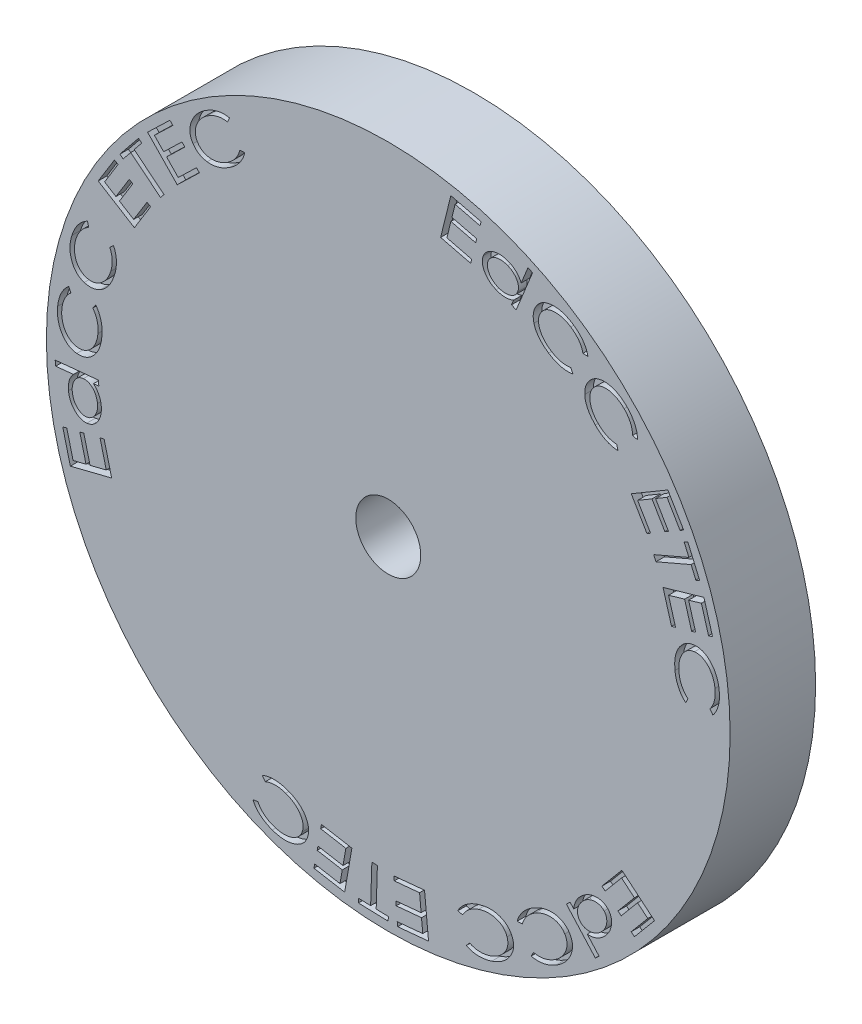
from build123d import *

# Parameters (mm, degrees)
SKETCH1_R           = 40
SKETCH1_R_2         = 3.8
BOSS_EXTRUDE1_DEPTH = 10
SKETCH2_R           = 38
SKETCH2_R_2         = 8.8
CUT_EXTRUDE1_DEPTH  = 8
CUT_EXTRUDE3_DEPTH  = 1
FILLET1_R           = 5


with BuildPart() as part:
    # Sketch1 → Boss-Extrude1 (new body)
    with BuildSketch(Plane.XY):
        Circle(SKETCH1_R)
        Circle(SKETCH1_R_2, mode=Mode.SUBTRACT)
    extrude(amount=BOSS_EXTRUDE1_DEPTH)

    # Sketch2 → Cut-Extrude1 (cut)
    with BuildSketch(Plane(origin=(0, 0, 0), x_dir=(-1, 0, 0), z_dir=(0, 0, -1))):
        Circle(SKETCH2_R)
        Circle(SKETCH2_R_2, mode=Mode.SUBTRACT)
    extrude(amount=-CUT_EXTRUDE1_DEPTH, mode=Mode.SUBTRACT)

    # Sketch3 → Cut-Extrude3 (cut)
    # profile 1 of 24: a face of its own
    with BuildSketch(Plane.XY.offset(10)):
        with BuildLine():
            Line((37.978912697, 0.916792387), (37.626348594, 1.38253758))
            add(Edge.make_bspline(
                [(37.626348594, 1.38253758), (37.65689347, 1.420895354), (37.717964794, 1.497587763), (37.800543831, 1.619163868), (37.87719497, 1.744624049), (37.946184144, 1.87485913), (38.00802287, 2.009534078), (38.064974655, 2.14772883), (38.112390702, 2.291659854), (38.154578011, 2.439267064), (38.1895872, 2.591044393), (38.217877396, 2.745739394), (38.237130974, 2.903335603), (38.252021856, 3.063283303), (38.25744207, 3.226113321), (38.256442418, 3.391835835), (38.24866743, 3.560283424), (38.237804838, 3.673239769), (38.232318146, 3.73029399)],
                knots=[0, 0, 0, 0, 0.944695008, 1.888820118, 2.830112549, 3.777105583, 4.727132214, 5.685403123, 6.65597313, 7.645866268, 8.643217823, 9.656690776, 10.675054052, 11.702080615, 12.751596859, 13.813291079, 14.895493883, 16, 16, 16, 16], degree=3))
            add(Edge.make_bspline(
                [(38.232318146, 3.73029399), (38.224963024, 3.79248674), (38.210353747, 3.916018506), (38.177024098, 4.098231772), (38.134677623, 4.275932112), (38.084766992, 4.449151841), (38.02661768, 4.618120579), (37.959410013, 4.782647329), (37.883232618, 4.942667266), (37.799496741, 5.09758278), (37.708486861, 5.245099124), (37.613102622, 5.384557968), (37.511018232, 5.512803218), (37.405900021, 5.633331347), (37.294117824, 5.742833969), (37.177085938, 5.842577755), (37.055965102, 5.933125501), (36.92954633, 6.013137513), (36.799929467, 6.083269108), (36.667101331, 6.142089367), (36.531300513, 6.187384967), (36.393863172, 6.224908359), (36.252733093, 6.246780876), (36.109594036, 6.26043012), (35.963749208, 6.261765857), (35.866486244, 6.252828371), (35.817454364, 6.248322836)],
                knots=[0, 0, 0, 0, 1.162821926, 2.309681537, 3.4376131, 4.554171539, 5.656156695, 6.754595195, 7.852876189, 8.945981921, 10.023216461, 11.070631578, 12.081589342, 13.065587487, 14.038940281, 14.984505581, 15.919522478, 16.844930552, 17.760398043, 18.654364109, 19.538666563, 20.416949128, 21.296631279, 22.186934506, 23.086003478, 24, 24, 24, 24], degree=3))
            add(Edge.make_bspline(
                [(35.817454364, 6.248322836), (35.743958576, 6.238170856), (35.59909263, 6.218160509), (35.390599724, 6.15614892), (35.193208079, 6.073731686), (35.009740566, 5.9631268), (34.836687829, 5.831949386), (34.676045574, 5.675833271), (34.529091018, 5.495309658), (34.39492527, 5.29391073), (34.276444004, 5.075747666), (34.176693091, 4.844591344), (34.098715628, 4.601945994), (34.040604134, 4.348608554), (34.002749044, 4.084599071), (33.985266831, 3.809734078), (33.986397532, 3.524090267), (34.004398804, 3.330902117), (34.013568146, 3.232497516)],
                knots=[0, 0, 0, 0, 0.909370223, 1.792439825, 2.660795442, 3.527932178, 4.413811027, 5.320778048, 6.269833555, 7.265329427, 8.286573303, 9.312565327, 10.350466134, 11.410002623, 12.498805054, 13.619819879, 14.787603297, 16, 16, 16, 16], degree=3))
            add(Edge.make_bspline(
                [(34.013568146, 3.232497516), (34.027811824, 3.124360612), (34.055757514, 2.9121991), (34.127417617, 2.603955124), (34.223991109, 2.312577857), (34.342955277, 2.03679572), (34.486996027, 1.777779444), (34.655437696, 1.535910403), (34.845652146, 1.307786262), (34.990947393, 1.172396544), (35.064249235, 1.104092067)],
                knots=[0, 0, 0, 0, 1.076591904, 2.112242513, 3.119367458, 4.104234891, 5.073869992, 6.040541146, 7.011447739, 8, 8, 8, 8], degree=3))
            Line((35.064249235, 1.104092067), (34.82386462, 0.57424431))
            add(Edge.make_bspline(
                [(34.82386462, 0.57424431), (34.780996422, 0.610110932), (34.695015849, 0.682048472), (34.57401721, 0.799927273), (34.458506312, 0.925197376), (34.349396039, 1.059061225), (34.244665068, 1.200277843), (34.147146286, 1.350578334), (34.054610018, 1.508175466), (33.968630035, 1.673280303), (33.88942512, 1.845776596), (33.817806687, 2.024805108), (33.752256309, 2.209365118), (33.695145669, 2.399917496), (33.646527112, 2.597021569), (33.603244447, 2.799635268), (33.567828539, 3.008468182), (33.551214756, 3.14994843), (33.54281494, 3.221479887)],
                knots=[0, 0, 0, 0, 0.889103455, 1.783271263, 2.685608027, 3.599135064, 4.529907922, 5.481772831, 6.448480153, 7.436954828, 8.442470498, 9.467445082, 10.504137484, 11.557948158, 12.631236183, 13.733594213, 14.854120541, 16, 16, 16, 16], degree=3))
            add(Edge.make_bspline(
                [(33.54281494, 3.221479887), (33.535903808, 3.289543144), (33.522236057, 3.424147949), (33.511872849, 3.624007651), (33.507523461, 3.819091894), (33.510648837, 4.009520916), (33.520065204, 4.195375723), (33.538647128, 4.376413052), (33.56298426, 4.552701867), (33.59674384, 4.723895931), (33.635308668, 4.890935151), (33.68224429, 5.053181215), (33.737839198, 5.210232061), (33.798739247, 5.363355302), (33.867670687, 5.511668647), (33.945386919, 5.654439411), (34.027836936, 5.793786388), (34.089764701, 5.881789547), (34.12073962, 5.92580681)],
                knots=[0, 0, 0, 0, 1.160163247, 2.294388412, 3.393160022, 4.469181983, 5.523940666, 6.548286478, 7.554902451, 8.541067507, 9.506647376, 10.461810256, 11.403806938, 12.331241486, 13.255906016, 14.175580921, 15.087465318, 16, 16, 16, 16], degree=3))
            add(Edge.make_bspline(
                [(34.12073962, 5.92580681), (34.174792573, 5.996402948), (34.28084449, 6.134912598), (34.460680902, 6.319688717), (34.651549457, 6.481319324), (34.855102853, 6.618290552), (35.070689184, 6.731933307), (35.299510514, 6.818095592), (35.539462995, 6.884355866), (35.705242679, 6.906932653), (35.789409492, 6.918394951)],
                knots=[0, 0, 0, 0, 1.064854578, 2.089245119, 3.083173113, 4.057578526, 5.024064495, 5.99680888, 6.982974221, 8, 8, 8, 8], degree=3))
            add(Edge.make_bspline(
                [(35.789409492, 6.918394951), (35.834109028, 6.922589724), (35.922704661, 6.930903871), (36.05557899, 6.9341261), (36.186231605, 6.927152881), (36.315515986, 6.916136949), (36.442597177, 6.89467815), (36.567583894, 6.865541769), (36.69124199, 6.829434589), (36.812424107, 6.784263498), (36.932353076, 6.73218447), (37.04983844, 6.671511241), (37.165909073, 6.60388198), (37.279498634, 6.52694818), (37.391322058, 6.442872245), (37.502272304, 6.351669762), (37.609796007, 6.25119263), (37.751745557, 6.10822396), (37.918743062, 5.915637887), (38.097563196, 5.664826047), (38.255358554, 5.396316415), (38.391383284, 5.109893165), (38.507459673, 4.806011428), (38.599356788, 4.48371914), (38.672979087, 4.144226411), (38.702196741, 3.910540106), (38.717093787, 3.791391746)],
                knots=[0, 0, 0, 0, 0.67895687, 1.345710016, 2.007934683, 2.657150602, 3.307190872, 3.955187974, 4.597532854, 5.254188935, 5.909990095, 6.573983775, 7.252996981, 7.940686534, 8.647666397, 9.368594163, 10.11186712, 10.872453247, 12.41543843, 13.961098682, 15.525234057, 17.119909552, 18.751794617, 20.439459267, 22.184606559, 24, 24, 24, 24], degree=3))
            add(Edge.make_bspline(
                [(38.717093787, 3.791391746), (38.724056378, 3.718655651), (38.737835425, 3.574710101), (38.747479641, 3.360474722), (38.748701757, 3.150627867), (38.74074724, 2.945083796), (38.723740378, 2.743889009), (38.698099402, 2.546870755), (38.661475589, 2.354886081), (38.617919358, 2.167151691), (38.564712515, 1.985836682), (38.50485274, 1.810770038), (38.436616358, 1.643735868), (38.361418552, 1.483210586), (38.277353865, 1.33058649), (38.185904174, 1.184673636), (38.087235631, 1.046197297), (38.014870265, 0.959748073), (37.978912697, 0.916792387)],
                knots=[0, 0, 0, 0, 1.149018235, 2.273919988, 3.371354041, 4.44859158, 5.507774624, 6.545950947, 7.571676933, 8.580394955, 9.575740584, 10.542176891, 11.488971327, 12.412070954, 13.328561029, 14.227448749, 15.119238439, 16, 16, 16, 16], degree=3))
        make_face()
    # profile 2 of 24: a face of its own
    with BuildSketch(Plane.XY.offset(10)):
        Polygon((36.934611213, 12.315885038), (37.940220187, 8.833312923), (37.46846538, 8.697094974), (36.638136854, 11.572695935), (35.140741021, 11.140003628), (35.963056726, 8.28944273), (35.494306726, 8.154226384), (34.671991021, 11.004787282), (32.79298461, 10.462920294), (33.615300315, 7.612359397), (33.143545508, 7.476141448), (32.145949354, 10.933673499), align=None)
    # profile 3 of 24: a face of its own
    with BuildSketch(Plane.XY.offset(10)):
        Polygon((34.609774148, 16.791613425), (35.052482482, 16.982919515), (36.43469402, 13.774786502), (35.991985687, 13.583480412), (35.430086648, 14.887566951), (31.314501713, 13.114730412), (31.058091456, 13.710683938), (35.173676392, 15.483520476), align=None)
    # profile 4 of 24: a face of its own
    with BuildSketch(Plane.XY.offset(10)):
        Polygon((32.711592133, 21.089196721), (34.560550466, 17.949172682), (34.138875787, 17.700775246), (32.612433479, 20.292922682), (31.273290851, 19.503659862), (32.786712325, 16.933547682), (32.367040851, 16.686151849), (30.853619377, 19.256264028), (29.173931877, 18.266680695), (30.687353351, 15.696568516), (30.265678671, 15.44817108), (28.429741171, 18.566159862), align=None)
    # profile 5 of 24: a face of its own
    with BuildSketch(Plane.XY.offset(10)):
        with BuildLine():
            Line((29.145568111, 24.401588099), (28.57866106, 24.544817265))
            add(Edge.make_bspline(
                [(28.57866106, 24.544817265), (28.578552653, 24.593911644), (28.578335599, 24.692209313), (28.567921444, 24.83934608), (28.549866313, 24.985769037), (28.524177993, 25.131402924), (28.48834236, 25.275502337), (28.446700687, 25.419592855), (28.395239078, 25.562483403), (28.336400472, 25.704699787), (28.268969524, 25.844829191), (28.194765368, 25.983172699), (28.113626645, 26.119797167), (28.024447503, 26.253649847), (27.928028144, 26.385466817), (27.823532315, 26.514321907), (27.712857537, 26.641846271), (27.633870113, 26.723327895), (27.594085739, 26.764368548)],
                knots=[0, 0, 0, 0, 0.944474898, 1.891045043, 2.836109699, 3.782505417, 4.734553645, 5.692048615, 6.66741629, 7.655292557, 8.652400737, 9.658389492, 10.675334408, 11.708785328, 12.75217274, 13.81670649, 14.900319046, 16, 16, 16, 16], degree=3))
            add(Edge.make_bspline(
                [(27.594085739, 26.764368548), (27.549470871, 26.808261297), (27.460650101, 26.89564445), (27.32034994, 27.017040521), (27.177018836, 27.130864876), (27.029518834, 27.235116495), (26.878154239, 27.330595378), (26.722566902, 27.416315885), (26.563996593, 27.495392058), (26.40181169, 27.563475394), (26.238890713, 27.623061166), (26.076756536, 27.67058426), (25.916834449, 27.709523143), (25.758851966, 27.736402625), (25.602943614, 27.752703697), (25.448963262, 27.757859192), (25.297044174, 27.751599292), (25.147370385, 27.735863927), (25.001566676, 27.709207666), (24.860480026, 27.670497007), (24.724358514, 27.62279392), (24.593250856, 27.564408913), (24.467607896, 27.495020752), (24.347542761, 27.414706453), (24.232170216, 27.324078542), (24.160743656, 27.256406693), (24.124534457, 27.222100919)],
                knots=[0, 0, 0, 0, 1.158393384, 2.306168277, 3.432677216, 4.545658585, 5.648311758, 6.743926591, 7.833018965, 8.927046114, 9.99849175, 11.042816922, 12.053248148, 13.04397814, 14.007099881, 14.95327411, 15.893494314, 16.819734825, 17.73743952, 18.634067007, 19.525481252, 20.405335004, 21.287833374, 22.179247618, 23.076982211, 24, 24, 24, 24], degree=3))
            add(Edge.make_bspline(
                [(24.124534457, 27.222100919), (24.07302182, 27.167888148), (23.9718061, 27.061367011), (23.846008387, 26.882198513), (23.742919334, 26.693678417), (23.665134818, 26.492945969), (23.61211036, 26.281319258), (23.58327582, 26.058484089), (23.578908227, 25.824846849), (23.598003337, 25.582983454), (23.641449648, 25.337733452), (23.706252067, 25.093787753), (23.794987107, 24.854448056), (23.907253644, 24.61984419), (24.042054211, 24.389371716), (24.198752342, 24.162477219), (24.378562256, 23.940404515), (24.512155654, 23.800060642), (24.580263624, 23.728511176)],
                knots=[0, 0, 0, 0, 0.914286131, 1.796454901, 2.670512629, 3.538675408, 4.423754635, 5.334618758, 6.282912495, 7.278968681, 8.29949574, 9.327433231, 10.364380157, 11.419067606, 12.50685088, 13.629061283, 14.791258956, 16, 16, 16, 16], degree=3))
            add(Edge.make_bspline(
                [(24.580263624, 23.728511176), (24.658782224, 23.652623975), (24.812893106, 23.503677824), (25.06233616, 23.308139599), (25.318759101, 23.138229745), (25.585730222, 22.998851515), (25.86053052, 22.885713888), (26.14380471, 22.800192409), (26.436206804, 22.74298204), (26.634649207, 22.7276356), (26.734710739, 22.719897394)],
                knots=[0, 0, 0, 0, 1.075086105, 2.110104685, 3.117186573, 4.101376874, 5.07188179, 6.040579392, 7.011992272, 8, 8, 8, 8], degree=3))
            Line((26.734710739, 22.719897394), (26.874935098, 22.153991945))
            add(Edge.make_bspline(
                [(26.874935098, 22.153991945), (26.818817397, 22.155398703), (26.706394654, 22.158216915), (26.537399916, 22.173293369), (26.368220029, 22.199528489), (26.198879472, 22.236029701), (26.02871197, 22.280715876), (25.858967549, 22.337522505), (25.687746039, 22.402322389), (25.51737621, 22.478867038), (25.346950737, 22.563223908), (25.179554883, 22.659465302), (25.013351967, 22.763010091), (24.849940955, 22.876815945), (24.688229127, 22.999054481), (24.529361832, 23.131299087), (24.372318695, 23.272998389), (24.271047815, 23.373203436), (24.219686701, 23.424023996)],
                knots=[0, 0, 0, 0, 0.892019335, 1.787016567, 2.69432426, 3.611201671, 4.539204994, 5.488950685, 6.454703834, 7.447654468, 8.456192122, 9.475683937, 10.51511432, 11.567547005, 12.639423828, 13.735971589, 14.851762517, 16, 16, 16, 16], degree=3))
            add(Edge.make_bspline(
                [(24.219686701, 23.424023996), (24.171876129, 23.473061614), (24.077509089, 23.569850558), (23.944580903, 23.719815179), (23.818834254, 23.869245628), (23.703926013, 24.021646974), (23.595448831, 24.172790184), (23.496874024, 24.3261019), (23.407025685, 24.479836782), (23.325070737, 24.634566719), (23.253622951, 24.790826034), (23.188864023, 24.947195335), (23.133650399, 25.104678445), (23.087957457, 25.26300968), (23.049177587, 25.421906071), (23.020366661, 25.582136616), (23.000133099, 25.743330145), (22.993184541, 25.851193598), (22.989718752, 25.904993548)],
                knots=[0, 0, 0, 0, 1.159716982, 2.289013794, 3.393044138, 4.466252645, 5.52055685, 6.543150469, 7.551703812, 8.535562, 9.507042887, 10.460453076, 11.401068406, 12.331534204, 13.250382554, 14.169804831, 15.087138379, 16, 16, 16, 16], degree=3))
            add(Edge.make_bspline(
                [(22.989718752, 25.904993548), (22.98819318, 25.994196728), (22.985197372, 26.169367426), (23.012508314, 26.426717224), (23.061798213, 26.673053059), (23.138046766, 26.907317955), (23.235873119, 27.131917116), (23.361798314, 27.34355385), (23.509627151, 27.545763288), (23.625967298, 27.667378967), (23.684830931, 27.728911817)],
                knots=[0, 0, 0, 0, 1.063125382, 2.087688063, 3.079414917, 4.054032713, 5.020269531, 5.994749049, 6.985420244, 8, 8, 8, 8], degree=3))
            add(Edge.make_bspline(
                [(23.684830931, 27.728911817), (23.717622491, 27.75990608), (23.782785505, 27.821497529), (23.884343448, 27.908227455), (23.991643112, 27.984764637), (24.100377975, 28.056807232), (24.213988453, 28.119490359), (24.33032351, 28.175704123), (24.44978274, 28.225372324), (24.573215333, 28.265882616), (24.69975159, 28.300569979), (24.830066204, 28.326073063), (24.963779685, 28.34530819), (25.100880726, 28.357073337), (25.241625435, 28.36239935), (25.385709606, 28.358938638), (25.53308696, 28.348886354), (25.733698778, 28.326291837), (25.984945636, 28.279029425), (26.28230901, 28.195794562), (26.574243064, 28.084815443), (26.860351305, 27.946430274), (27.139258522, 27.778385652), (27.413621286, 27.585673908), (27.682240373, 27.364677859), (27.85132349, 27.199996175), (27.937635419, 27.115931048)],
                knots=[0, 0, 0, 0, 0.680241802, 1.351768802, 2.011208947, 2.665964701, 3.317151008, 3.965491055, 4.613244704, 5.265830076, 5.922710474, 6.589998759, 7.266225096, 7.958428435, 8.663540768, 9.388494346, 10.130100607, 10.889930039, 12.430952623, 13.978275232, 15.539412222, 17.133223223, 18.762958192, 20.442854317, 22.184182374, 24, 24, 24, 24], degree=3))
            add(Edge.make_bspline(
                [(27.937635419, 27.115931048), (27.988504782, 27.063269448), (28.089022775, 26.959209992), (28.230144964, 26.797576571), (28.36156614, 26.634261059), (28.483377438, 26.46881505), (28.594162741, 26.300155724), (28.696978454, 26.130396535), (28.788060815, 25.957098381), (28.87016191, 25.782859141), (28.941289154, 25.607159587), (29.002120835, 25.432237047), (29.054031287, 25.258350202), (29.093817692, 25.08535403), (29.123407474, 24.91316236), (29.140962629, 24.741836135), (29.149707589, 24.571265996), (29.146944743, 24.458016487), (29.145568111, 24.401588099)],
                knots=[0, 0, 0, 0, 1.149859686, 2.272125689, 3.368713274, 4.441675222, 5.497573881, 6.537187503, 7.557592476, 8.571020886, 9.561352832, 10.533185891, 11.478977851, 12.410104345, 13.319613216, 14.221272642, 15.113720508, 16, 16, 16, 16], degree=3))
        make_face()
    # profile 6 of 24: a face of its own
    with BuildSketch(Plane.XY.offset(10)):
        with BuildLine():
            Line((23.355850751, 29.941352739), (22.773919662, 29.965391201))
            add(Edge.make_bspline(
                [(22.773919662, 29.965391201), (22.763897249, 30.013297438), (22.743831675, 30.10920909), (22.701859669, 30.249947849), (22.653933903, 30.38885456), (22.597973278, 30.52508679), (22.533164554, 30.658339956), (22.462694314, 30.790200191), (22.381682815, 30.918055654), (22.294856738, 31.044312078), (22.200816197, 31.16752249), (22.099148881, 31.286858231), (21.99146427, 31.402749011), (21.876517887, 31.514799558), (21.754192906, 31.621869806), (21.627374422, 31.728307411), (21.49158231, 31.827812143), (21.397911489, 31.891423858), (21.350642418, 31.923524213)],
                knots=[0, 0, 0, 0, 0.94441214, 1.890779427, 2.832438719, 3.78034093, 4.731589421, 5.691898972, 6.664713808, 7.651539203, 8.649248263, 9.655187315, 10.676655904, 11.702122032, 12.752223108, 13.814241667, 14.897001594, 16, 16, 16, 16], degree=3))
            add(Edge.make_bspline(
                [(21.350642418, 31.923524213), (21.29788259, 31.957116679), (21.193166877, 32.023789735), (21.03145692, 32.113608476), (20.868356737, 32.195266384), (20.702575869, 32.266160045), (20.535342429, 32.32875416), (20.365614635, 32.380629995), (20.194133657, 32.423805469), (20.021658473, 32.457863166), (19.850426259, 32.481697528), (19.682577032, 32.49600667), (19.519017506, 32.500114442), (19.359424856, 32.494257086), (19.203861052, 32.478140412), (19.052349191, 32.452709607), (18.90578191, 32.414751208), (18.763479819, 32.369448039), (18.627358006, 32.313089271), (18.497432578, 32.248078293), (18.375159174, 32.172923076), (18.260441468, 32.08788526), (18.151945199, 31.995160598), (18.051704306, 31.892110119), (17.957484851, 31.780824844), (17.902110569, 31.700009926), (17.874079918, 31.659101136)],
                knots=[0, 0, 0, 0, 1.16207492, 2.306442363, 3.435725061, 4.550185152, 5.655402065, 6.752438806, 7.846401009, 8.940275241, 10.01775129, 11.057501868, 12.069105287, 13.056289217, 14.023063837, 14.973697647, 15.908159007, 16.834241234, 17.746756825, 18.642970482, 19.531484326, 20.410043067, 21.294301053, 22.180537514, 23.078981843, 24, 24, 24, 24], degree=3))
            add(Edge.make_bspline(
                [(17.874079918, 31.659101136), (17.83495091, 31.595926521), (17.757890852, 31.471511419), (17.673406749, 31.270619297), (17.612271411, 31.065498872), (17.578017015, 30.853769382), (17.570314394, 30.636494612), (17.588818796, 30.413697324), (17.633938603, 30.185546146), (17.704116206, 29.954411429), (17.79629711, 29.723952311), (17.912698308, 29.500876076), (18.048759872, 29.285896177), (18.207919165, 29.080874118), (18.385861165, 28.883096255), (18.58700867, 28.695527655), (18.808163798, 28.515476022), (18.968318132, 28.406408247), (19.049961328, 28.350807867)],
                knots=[0, 0, 0, 0, 0.911379636, 1.79485684, 2.66671684, 3.534915191, 4.421156727, 5.330292412, 6.274326721, 7.271845739, 8.292859391, 9.317972905, 10.357603738, 11.413066181, 12.501679592, 13.621330804, 14.787406179, 16, 16, 16, 16], degree=3))
            add(Edge.make_bspline(
                [(19.049961328, 28.350807867), (19.142159123, 28.29304775), (19.323107556, 28.179687091), (19.606614092, 28.040757469), (19.89149749, 27.927906602), (20.180652901, 27.846816492), (20.472038746, 27.793382753), (20.766140518, 27.767881867), (21.062940714, 27.7722923), (21.259665754, 27.798005525), (21.358655239, 27.810944085)],
                knots=[0, 0, 0, 0, 1.074816789, 2.109447549, 3.115767674, 4.099943151, 5.072871302, 6.040073259, 7.013790324, 8, 8, 8, 8], degree=3))
            Line((21.358655239, 27.810944085), (21.61306229, 27.288107547))
            add(Edge.make_bspline(
                [(21.61306229, 27.288107547), (21.5580857, 27.277721244), (21.447952604, 27.256914648), (21.279929689, 27.238331424), (21.109705711, 27.229483364), (20.936877706, 27.229691476), (20.761570822, 27.238079278), (20.584163497, 27.258907357), (20.404383992, 27.288062362), (20.222411153, 27.325839805), (20.039177584, 27.373889721), (19.855934406, 27.432469605), (19.672424459, 27.499060565), (19.489853459, 27.577257858), (19.306469064, 27.662561695), (19.124137218, 27.759933804), (18.940495635, 27.864025771), (18.820899921, 27.941225332), (18.760498187, 27.980214919)],
                knots=[0, 0, 0, 0, 0.891598599, 1.786115073, 2.692130934, 3.607523885, 4.540113854, 5.488111611, 6.453180309, 7.442681323, 8.449562373, 9.4712439, 10.508402474, 11.560137452, 12.636258481, 13.73136041, 14.854225107, 16, 16, 16, 16], degree=3))
            add(Edge.make_bspline(
                [(18.760498187, 27.980214919), (18.703791851, 28.018201316), (18.591711872, 28.093281368), (18.430433051, 28.21170647), (18.277403171, 28.333003192), (18.131610566, 28.455731115), (17.995728872, 28.582535152), (17.866439533, 28.710272588), (17.748267738, 28.842957047), (17.635756749, 28.976269481), (17.533146165, 29.113518047), (17.437871146, 29.252837255), (17.349847137, 29.394272703), (17.272379233, 29.539165781), (17.20271467, 29.686671459), (17.140649723, 29.836217519), (17.087097401, 29.989052373), (17.058212754, 30.092757261), (17.043751392, 30.14467806)],
                knots=[0, 0, 0, 0, 1.158631315, 2.290032888, 3.395656215, 4.473381418, 5.524210937, 6.550228583, 7.557555184, 8.539445237, 9.510941145, 10.465220995, 11.404297634, 12.337523164, 13.252813077, 14.172776841, 15.085184054, 16, 16, 16, 16], degree=3))
            add(Edge.make_bspline(
                [(17.043751392, 30.14467806), (17.023513411, 30.231147695), (16.983815352, 30.400763259), (16.957175381, 30.656800212), (16.952642888, 30.906470598), (16.977474604, 31.150594058), (17.02688414, 31.389132241), (17.106005074, 31.620726281), (17.207069094, 31.848249607), (17.295421318, 31.990573089), (17.340225751, 32.06274697)],
                knots=[0, 0, 0, 0, 1.063827839, 2.086764424, 3.079595986, 4.053088869, 5.022697479, 5.993627331, 6.982545253, 8, 8, 8, 8], degree=3))
            add(Edge.make_bspline(
                [(17.340225751, 32.06274697), (17.365476667, 32.099806466), (17.415633704, 32.17341942), (17.49836222, 32.277131405), (17.58413319, 32.376173928), (17.676537966, 32.467207787), (17.774030613, 32.551246951), (17.875458751, 32.62979963), (17.981580797, 32.702143141), (18.093288009, 32.76720008), (18.209678068, 32.826356741), (18.330905542, 32.879631214), (18.457377555, 32.925755568), (18.588689987, 32.964409599), (18.724676348, 32.997732211), (18.865377796, 33.024753666), (19.011206385, 33.044498317), (19.211730665, 33.063243772), (19.466627167, 33.070462433), (19.773943012, 33.04840822), (20.081346874, 33.000472468), (20.388928649, 32.923726687), (20.696083208, 32.818615476), (21.003689054, 32.686923526), (21.310829658, 32.526344537), (21.509729014, 32.401028717), (21.611059085, 32.337186072)],
                knots=[0, 0, 0, 0, 0.678619719, 1.347973083, 2.006942283, 2.660950541, 3.309467777, 3.954430386, 4.602060794, 5.252171272, 5.909918308, 6.577552194, 7.255475208, 7.946275225, 8.648662717, 9.374233275, 10.114010695, 10.875414981, 12.422486714, 13.967625464, 15.533080193, 17.126609523, 18.760033912, 20.442338605, 22.187535192, 24, 24, 24, 24], degree=3))
            add(Edge.make_bspline(
                [(21.611059085, 32.337186072), (21.67181779, 32.296256764), (21.791563098, 32.2155919), (21.963497087, 32.087815914), (22.126097339, 31.955666619), (22.278852003, 31.818276508), (22.423964736, 31.678007717), (22.55907058, 31.532942698), (22.684438841, 31.383253838), (22.800735998, 31.230359409), (22.906396286, 31.074159937), (23.003364968, 30.916967587), (23.088153696, 30.757357207), (23.163714304, 30.597179673), (23.228280106, 30.435378017), (23.280943859, 30.271894133), (23.324793578, 30.107490814), (23.345524459, 29.996592482), (23.355850751, 29.941352739)],
                knots=[0, 0, 0, 0, 1.15311838, 2.272604657, 3.370892143, 4.450279622, 5.505834455, 6.547082538, 7.56926775, 8.578384706, 9.569646862, 10.53683269, 11.484413267, 12.413134998, 13.32371483, 14.224550341, 15.115627971, 16, 16, 16, 16], degree=3))
        make_face()
    # profile 7 of 24: a face of its own
    with BuildSketch(Plane.XY.offset(10)):
        with BuildLine():
            Line((16.89214415, 35.18981057), (14.965060816, 30.469257685))
            Line((14.965060816, 30.469257685), (14.412176201, 30.694618262))
            Line((14.412176201, 30.694618262), (14.650557611, 31.27955416))
            add(Edge.make_bspline(
                [(14.650557611, 31.27955416), (14.56925067, 31.250598503), (14.407790597, 31.193098094), (14.158356871, 31.135198499), (13.906659084, 31.103450687), (13.653045608, 31.09473571), (13.397389604, 31.113433182), (13.140027093, 31.157154542), (12.880513316, 31.224652581), (12.711254908, 31.288967043), (12.625317227, 31.321621467)],
                knots=[0, 0, 0, 0, 0.996828704, 1.979511624, 2.951961157, 3.924747415, 4.907218226, 5.90878468, 6.938225889, 8, 8, 8, 8], degree=3))
            add(Edge.make_bspline(
                [(12.625317227, 31.321621467), (12.550380638, 31.354305658), (12.402715696, 31.418710899), (12.192669674, 31.531817679), (11.999075517, 31.659833483), (11.819224675, 31.799106272), (11.656102431, 31.953111675), (11.506664629, 32.118538327), (11.374352192, 32.29836093), (11.256837141, 32.487475073), (11.159196781, 32.683323112), (11.083540937, 32.880157685), (11.030056989, 33.075692948), (11.002538556, 33.270444814), (10.995029929, 33.464176554), (11.015717246, 33.656296686), (11.055480008, 33.847890797), (11.101554823, 33.970693669), (11.124916586, 34.032959608)],
                knots=[0, 0, 0, 0, 1.141051018, 2.248477481, 3.32534945, 4.378012308, 5.420023444, 6.453146101, 7.486047933, 8.532500947, 9.558067673, 10.5362313, 11.472393003, 12.381391605, 13.276748345, 14.17140114, 15.072827672, 16, 16, 16, 16], degree=3))
            add(Edge.make_bspline(
                [(11.124916586, 34.032959608), (11.151503712, 34.09247406), (11.204074457, 34.210152029), (11.307887986, 34.372329834), (11.428774231, 34.519387629), (11.567185932, 34.652201115), (11.724646125, 34.768079124), (11.899146775, 34.870481028), (12.092803396, 34.954401037), (12.300278764, 35.025348431), (12.518008561, 35.077473478), (12.73973126, 35.112033941), (12.963693907, 35.126148175), (13.189186361, 35.119652111), (13.416453216, 35.094864523), (13.645060789, 35.048781985), (13.875849573, 34.984453464), (14.026997417, 34.92599835), (14.103682611, 34.896341019)],
                knots=[0, 0, 0, 0, 0.909713097, 1.798776384, 2.680355456, 3.564571669, 4.471409862, 5.405877886, 6.385356571, 7.415013197, 8.466087569, 9.509129669, 10.546764903, 11.596710373, 12.657378056, 13.73688595, 14.851804064, 16, 16, 16, 16], degree=3))
            add(Edge.make_bspline(
                [(14.103682611, 34.896341019), (14.190279022, 34.85856905), (14.359865116, 34.784598311), (14.596558509, 34.64792332), (14.811491515, 34.494904102), (15.004548335, 34.324649021), (15.174803463, 34.136929719), (15.323705395, 33.933321795), (15.449809875, 33.711745625), (15.514313537, 33.553987589), (15.546991906, 33.474065378)],
                knots=[0, 0, 0, 0, 1.085309448, 2.125415898, 3.135018883, 4.11378479, 5.078263479, 6.042406144, 7.008258257, 8, 8, 8, 8], degree=3))
            Line((15.546991906, 33.474065378), (16.339259534, 35.415171147))
            Line((16.339259534, 35.415171147), (16.89214415, 35.18981057))
        make_face()
        with BuildLine():
            add(Edge.make_bspline(
                [(13.975477483, 34.45563589), (13.897865195, 34.48456631), (13.744865939, 34.541597647), (13.508877466, 34.599375144), (13.272222074, 34.627723401), (13.075494141, 34.631875658), (12.920828129, 34.62097569), (12.808033479, 34.607240077), (12.698580772, 34.586221617), (12.592357187, 34.557862607), (12.488761906, 34.524049591), (12.388367341, 34.482814168), (12.291413048, 34.434767539), (12.198509495, 34.380724586), (12.110249365, 34.321861548), (12.028655875, 34.25814506), (11.953510423, 34.190341666), (11.885487311, 34.118359341), (11.824155043, 34.042010837), (11.769625606, 33.961430793), (11.722548649, 33.876511312), (11.696702781, 33.817167686), (11.683810816, 33.78756698)],
                knots=[0, 0, 0, 0, 1.878917233, 3.703961639, 5.498242839, 7.27927387, 8.160381711, 9.015695422, 9.856860672, 10.687653912, 11.50958742, 12.328581443, 13.148696513, 13.963613815, 14.76646286, 15.554695384, 16.311143894, 17.061609769, 17.80008161, 18.531482459, 19.267500833, 20, 20, 20, 20], degree=3))
            add(Edge.make_bspline(
                [(11.683810816, 33.78756698), (11.672248483, 33.757369628), (11.649183201, 33.697130014), (11.624343196, 33.603478276), (11.607631929, 33.50794586), (11.596874379, 33.410567309), (11.596683709, 33.310698237), (11.602669229, 33.209017265), (11.615280158, 33.105059792), (11.637957996, 33.000542615), (11.666414543, 32.895988914), (11.702782865, 32.793303087), (11.745988932, 32.693464319), (11.794961674, 32.595278783), (11.852739585, 32.500680517), (11.915304016, 32.406772356), (11.986924938, 32.317211155), (12.089791842, 32.200594799), (12.23212878, 32.065438314), (12.420198854, 31.921930053), (12.624524426, 31.796703651), (12.771387793, 31.731968178), (12.845669791, 31.699225634)],
                knots=[0, 0, 0, 0, 0.733748741, 1.463729007, 2.19528183, 2.934452962, 3.684925704, 4.459437119, 5.246386256, 6.059584381, 6.885298566, 7.705216725, 8.530339212, 9.35410267, 10.193892543, 11.045369374, 11.914313359, 12.7949815, 14.575008978, 16.359453284, 18.158648495, 20, 20, 20, 20], degree=3))
            add(Edge.make_bspline(
                [(12.845669791, 31.699225634), (12.922587224, 31.670460945), (13.075122036, 31.613417746), (13.312331407, 31.558581988), (13.551706751, 31.525172841), (13.752549334, 31.52116334), (13.911327722, 31.528593645), (14.026782511, 31.541543704), (14.138082403, 31.561796393), (14.245193976, 31.587596753), (14.347630089, 31.619629835), (14.445708981, 31.658057995), (14.539799587, 31.702647989), (14.628583746, 31.755241703), (14.713231699, 31.811910788), (14.791329481, 31.875281709), (14.863670237, 31.943870969), (14.93100454, 32.016578966), (14.991624253, 32.095410202), (15.045221508, 32.180034456), (15.095182061, 32.268714216), (15.121890372, 32.33162417), (15.135333252, 32.363288134)],
                knots=[0, 0, 0, 0, 1.856408838, 3.681440715, 5.495604684, 7.31681745, 8.2169519, 9.091259472, 9.94331857, 10.775178042, 11.582774132, 12.369790915, 13.157097709, 13.935803781, 14.702693809, 15.460148977, 16.208317307, 16.956866948, 17.700290785, 18.454688262, 19.222210592, 20, 20, 20, 20], degree=3))
            add(Edge.make_bspline(
                [(15.135333252, 32.363288134), (15.153423209, 32.412357456), (15.18906166, 32.509027371), (15.223623456, 32.658573214), (15.23806169, 32.808294479), (15.236838254, 32.95831426), (15.214874229, 33.108523984), (15.175814947, 33.25908997), (15.117613582, 33.409546076), (15.042684979, 33.558493622), (14.953444889, 33.703441966), (14.850965953, 33.840642578), (14.734890381, 33.967051731), (14.607209554, 34.084613161), (14.467656911, 34.193071007), (14.31555333, 34.291566651), (14.150855828, 34.379933424), (14.034631843, 34.430101775), (13.975477483, 34.45563589)],
                knots=[0, 0, 0, 0, 0.94205429, 1.855911262, 2.757118118, 3.647856044, 4.553392566, 5.486097168, 6.446144117, 7.45538502, 8.487529244, 9.510580751, 10.537183764, 11.576356714, 12.635669778, 13.718984365, 14.839034647, 16, 16, 16, 16], degree=3))
        make_face(mode=Mode.SUBTRACT)
    # profile 8 of 24: a face of its own
    with BuildSketch(Plane.XY.offset(10)):
        Polygon((7.322622256, 38.220445634), (10.858279307, 37.346046596), (10.740090205, 36.869283775), (7.82041873, 37.591439224), (7.446820974, 36.080020955), (10.341452384, 35.363875122), (10.224264884, 34.890117109), (7.329633474, 35.606262942), (6.860883474, 33.710229288), (9.755514884, 32.994083455), (9.637325782, 32.517320634), (6.126708794, 33.385710057), align=None)
    # profile 9 of 24: a face of its own
    with BuildSketch(Plane.XY.offset(10)):
        with BuildLine():
            Line((-18.567964185, 33.141260874), (-18.813356813, 32.61241472))
            add(Edge.make_bspline(
                [(-18.813356813, 32.61241472), (-18.861680888, 32.621311099), (-18.957952586, 32.639034552), (-19.104144223, 32.655829269), (-19.250914212, 32.664753552), (-19.398405619, 32.666139622), (-19.546509222, 32.657612722), (-19.695300344, 32.641775851), (-19.845042249, 32.61748615), (-20.045959092, 32.57476329), (-20.296583714, 32.500036398), (-20.59293559, 32.38082615), (-20.887332563, 32.232863209), (-21.07468541, 32.112057261), (-21.170127647, 32.050515682)],
                knots=[0, 0, 0, 0, 0.710664674, 1.415793157, 2.12711403, 2.837121897, 3.54816396, 4.271952407, 5.000879409, 5.741663015, 7.242409788, 8.776980086, 10.358112857, 12, 12, 12, 12], degree=3))
            add(Edge.make_bspline(
                [(-21.170127647, 32.050515682), (-21.221567025, 32.014614863), (-21.323512456, 31.943464618), (-21.469051724, 31.828897899), (-21.606212347, 31.708620301), (-21.735685668, 31.58335344), (-21.857282917, 31.452561145), (-21.971502842, 31.316908), (-22.076894143, 31.174686696), (-22.174547903, 31.028813182), (-22.262149986, 30.879664724), (-22.34112247, 30.73087542), (-22.406783906, 30.580810954), (-22.463859837, 30.431830064), (-22.507419124, 30.281850742), (-22.542051583, 30.132492519), (-22.565124946, 29.982837415), (-22.577069913, 29.833881104), (-22.57854865, 29.686524067), (-22.567243847, 29.541850587), (-22.545209806, 29.400190291), (-22.512288412, 29.261342015), (-22.467049298, 29.126053757), (-22.410148807, 28.994090915), (-22.34380894, 28.864588021), (-22.290641183, 28.782528072), (-22.263877647, 28.74122081)],
                knots=[0, 0, 0, 0, 1.165939902, 2.310724753, 3.441084088, 4.555950678, 5.658220876, 6.759634534, 7.850752574, 8.94727645, 10.021296762, 11.065123525, 12.076562868, 13.064496868, 14.02875205, 14.977299076, 15.913028, 16.840798407, 17.753182531, 18.649529711, 19.535241741, 20.415894263, 21.29910197, 22.183334039, 23.085528351, 24, 24, 24, 24], degree=3))
            add(Edge.make_bspline(
                [(-22.263877647, 28.74122081), (-22.220587093, 28.681273474), (-22.135084159, 28.562871819), (-21.983127826, 28.407846599), (-21.817774754, 28.272133533), (-21.63496862, 28.161439285), (-21.438091143, 28.070039762), (-21.225345025, 28.002197132), (-20.997558707, 27.956737951), (-20.757440756, 27.931772646), (-20.509685125, 27.930503516), (-20.258801316, 27.949948013), (-20.008275681, 27.994913041), (-19.757313124, 28.061394298), (-19.506446388, 28.151001307), (-19.255600639, 28.264039416), (-19.004199259, 28.399137136), (-18.841996893, 28.504958184), (-18.759270275, 28.558929143)],
                knots=[0, 0, 0, 0, 0.90770014, 1.792793556, 2.659237168, 3.530496628, 4.411777022, 5.321450617, 6.267838299, 7.262068987, 8.283853404, 9.308895482, 10.350517629, 11.407552442, 12.496475046, 13.62057235, 14.786441863, 16, 16, 16, 16], degree=3))
            add(Edge.make_bspline(
                [(-18.759270275, 28.558929143), (-18.670266114, 28.621811349), (-18.495408091, 28.745350046), (-18.257833886, 28.954204266), (-18.045154543, 29.175184993), (-17.857623432, 29.409600415), (-17.6956101, 29.657671522), (-17.560048953, 29.919442155), (-17.449022849, 30.19434932), (-17.397188506, 30.385573964), (-17.371049121, 30.482006067)],
                knots=[0, 0, 0, 0, 1.076338311, 2.114579675, 3.120348545, 4.104032281, 5.076837948, 6.043440992, 7.013332719, 8, 8, 8, 8], degree=3))
            Line((-17.371049121, 30.482006067), (-16.791121236, 30.517062156))
            add(Edge.make_bspline(
                [(-16.791121236, 30.517062156), (-16.802778763, 30.462471723), (-16.826133805, 30.353103594), (-16.873958633, 30.19134791), (-16.93142738, 30.031121702), (-16.996929665, 29.871348821), (-17.074961803, 29.714208848), (-17.161219895, 29.557844964), (-17.256014919, 29.401993297), (-17.362795472, 29.249337244), (-17.477127263, 29.098455471), (-17.601165965, 28.951677101), (-17.733613009, 28.808429265), (-17.874359549, 28.668069169), (-18.025531395, 28.532908191), (-18.184610201, 28.400577205), (-18.352785955, 28.272361993), (-18.469822412, 28.191230147), (-18.528901685, 28.150275297)],
                knots=[0, 0, 0, 0, 0.88943988, 1.781930802, 2.685755747, 3.601841357, 4.532356574, 5.480267795, 6.447664655, 7.438129861, 8.448142862, 9.464012355, 10.499592691, 11.556928677, 12.630793183, 13.730452871, 14.854346779, 16, 16, 16, 16], degree=3))
            add(Edge.make_bspline(
                [(-18.528901685, 28.150275297), (-18.585683233, 28.112394569), (-18.697916011, 28.037520607), (-18.869625229, 27.93502685), (-19.039547977, 27.839338149), (-19.209502066, 27.753257157), (-19.378057379, 27.674512588), (-19.547230661, 27.607237039), (-19.713886264, 27.544966217), (-19.88078912, 27.494546656), (-20.046298085, 27.450787847), (-20.211496493, 27.41678599), (-20.376038028, 27.391982796), (-20.539431557, 27.374454244), (-20.702289532, 27.366796735), (-20.8644117, 27.366539048), (-21.026000764, 27.375139854), (-21.13279585, 27.388427921), (-21.186153288, 27.395066964)],
                knots=[0, 0, 0, 0, 1.158791498, 2.290434024, 3.3944056, 4.46935203, 5.524504888, 6.551928548, 7.559805107, 8.54424491, 9.510846466, 10.465858719, 11.406290293, 12.335324985, 13.254798054, 14.173152031, 15.08726206, 16, 16, 16, 16], degree=3))
            add(Edge.make_bspline(
                [(-21.186153288, 27.395066964), (-21.273635348, 27.409793262), (-21.445372991, 27.43870273), (-21.692991368, 27.509237957), (-21.924728399, 27.60252658), (-22.140262291, 27.718720555), (-22.341548317, 27.855406806), (-22.525736383, 28.015878694), (-22.696619948, 28.196651584), (-22.793598585, 28.332666062), (-22.842803929, 28.401677541)],
                knots=[0, 0, 0, 0, 1.064158844, 2.089069812, 3.083226066, 4.056751787, 5.022626957, 5.997108893, 6.983766441, 8, 8, 8, 8], degree=3))
            add(Edge.make_bspline(
                [(-22.842803929, 28.401677541), (-22.86739969, 28.43906985), (-22.916314976, 28.513434512), (-22.979278263, 28.630030519), (-23.037808746, 28.74714746), (-23.084782007, 28.867683593), (-23.126955322, 28.98929785), (-23.159093132, 29.113407149), (-23.186327457, 29.23917158), (-23.202273772, 29.367555667), (-23.213225827, 29.497557431), (-23.213281944, 29.629711432), (-23.207836975, 29.763828099), (-23.1930919, 29.900129366), (-23.172911287, 30.038472667), (-23.141664402, 30.178178465), (-23.105107953, 30.320424671), (-23.044700783, 30.512720573), (-22.952066245, 30.750251485), (-22.815353246, 31.026541274), (-22.651206927, 31.291158404), (-22.462081744, 31.545303703), (-22.247543644, 31.78906746), (-22.005936487, 32.020780942), (-21.740566086, 32.244785377), (-21.547824298, 32.380151192), (-21.449574762, 32.449153502)],
                knots=[0, 0, 0, 0, 0.677148852, 1.346692565, 2.004421118, 2.657590581, 3.303248256, 3.951728125, 4.596970313, 5.249533404, 5.908464635, 6.570528035, 7.248411986, 7.939357049, 8.644806396, 9.363455596, 10.105052488, 10.867502369, 12.413213172, 13.959138766, 15.527152416, 17.120117013, 18.749384394, 20.436345244, 22.183437898, 24, 24, 24, 24], degree=3))
            add(Edge.make_bspline(
                [(-21.449574762, 32.449153502), (-21.388468825, 32.489400352), (-21.267725346, 32.568926907), (-21.083060389, 32.677858207), (-20.898541607, 32.777624804), (-20.713476914, 32.866326954), (-20.528328383, 32.946321942), (-20.342789303, 33.015255951), (-20.156359728, 33.073231964), (-19.970800474, 33.122973756), (-19.785593166, 33.159963546), (-19.603405864, 33.1905071), (-19.423610754, 33.206340235), (-19.246803324, 33.21555207), (-19.072920045, 33.211600034), (-18.901512744, 33.200672608), (-18.733360235, 33.176143374), (-18.622939599, 33.152855346), (-18.567964185, 33.141260874)],
                knots=[0, 0, 0, 0, 1.151921889, 2.276162728, 3.374542343, 4.453746727, 5.506390583, 6.549275804, 7.568467569, 8.579601709, 9.572422782, 10.541238842, 11.486448982, 12.41260974, 13.327437446, 14.223325475, 15.115442369, 16, 16, 16, 16], degree=3))
        make_face()
    # profile 10 of 24: a face of its own
    with BuildSketch(Plane.XY.offset(10)):
        Polygon((-28.15783035, 26.90296591), (-25.545650863, 29.425001166), (-25.203102786, 29.070433859), (-27.359553107, 26.988102128), (-26.275819132, 25.865305654), (-24.138399261, 27.929608538), (-23.798855991, 27.578046038), (-25.936275863, 25.513743154), (-24.575097979, 24.104488346), (-22.437678107, 26.168791231), (-22.096131632, 25.815225525), (-24.689280671, 23.311219115), align=None)
    # profile 11 of 24: a face of its own
    with BuildSketch(Plane.XY.offset(10)):
        Polygon((-31.021242569, 22.757005025), (-31.396843531, 23.060490602), (-29.215353146, 25.763815923), (-28.839752185, 25.460330346), (-29.727172057, 24.361572333), (-26.235585518, 21.54406432), (-26.641234557, 21.041259833), (-30.132821095, 23.858767846), align=None)
    # profile 12 of 24: a face of its own
    with BuildSketch(Plane.XY.offset(10)):
        Polygon((-33.93728639, 19.070768683), (-32.03123671, 22.157707786), (-31.613568441, 21.900295927), (-33.187086069, 19.352219004), (-31.862967479, 18.533909709), (-30.302470684, 21.059951376), (-29.887807223, 20.803541119), (-31.448304018, 18.277499453), (-29.786645364, 17.251858427), (-28.226148569, 19.777900094), (-27.8084803, 19.519486632), (-29.701509146, 16.454582786), align=None)
    # profile 13 of 24: a face of its own
    with BuildSketch(Plane.XY.offset(10)):
        with BuildLine():
            Line((-35.188950075, 14.37027975), (-35.051730523, 13.800367891))
            add(Edge.make_bspline(
                [(-35.051730523, 13.800367891), (-35.095091571, 13.77717054), (-35.181840657, 13.730761399), (-35.306472168, 13.652156916), (-35.427660354, 13.568328413), (-35.542319751, 13.475380357), (-35.654419996, 13.377302626), (-35.760905092, 13.271109205), (-35.863610036, 13.158808764), (-35.960478334, 13.03943879), (-36.052811457, 12.914147254), (-36.139619308, 12.782855432), (-36.222233905, 12.646593571), (-36.298198689, 12.504369188), (-36.367916439, 12.35648806), (-36.434637952, 12.20433222), (-36.494916975, 12.045912929), (-36.529597508, 11.937224277), (-36.547123152, 11.88229898)],
                knots=[0, 0, 0, 0, 0.944441423, 1.889470706, 2.828977093, 3.773570959, 4.723290027, 5.689329224, 6.660952203, 7.645654946, 8.641139997, 9.649782848, 10.668369305, 11.701393141, 12.745685329, 13.808544253, 14.892558197, 16, 16, 16, 16], degree=3))
            add(Edge.make_bspline(
                [(-36.547123152, 11.88229898), (-36.565180349, 11.82205546), (-36.601053833, 11.702372159), (-36.642128237, 11.52117972), (-36.675995444, 11.341228964), (-36.699009915, 11.161638903), (-36.711790872, 10.982732761), (-36.715843, 10.804569088), (-36.711167086, 10.627333774), (-36.695928007, 10.451831448), (-36.672261951, 10.279902925), (-36.639190585, 10.11409274), (-36.598264406, 9.954728177), (-36.547984601, 9.80266635), (-36.490268944, 9.656754383), (-36.422429972, 9.518324711), (-36.348003811, 9.385756119), (-36.263461654, 9.261485165), (-36.171679835, 9.145713675), (-36.073050849, 9.038366844), (-35.96655445, 8.941629543), (-35.854315392, 8.852758325), (-35.734622804, 8.774365406), (-35.607687891, 8.706351695), (-35.474246653, 8.646584786), (-35.381203848, 8.615005248), (-35.334182446, 8.599045775)],
                knots=[0, 0, 0, 0, 1.164176957, 2.312822046, 3.438022075, 4.553671886, 5.66313886, 6.757607076, 7.852232406, 8.944183715, 10.01776439, 11.064033564, 12.073116539, 13.062291071, 14.027710453, 14.976036467, 15.914559771, 16.840436172, 17.755685232, 18.648102313, 19.536334405, 20.416853208, 21.296438396, 22.181545746, 23.081000757, 24, 24, 24, 24], degree=3))
            add(Edge.make_bspline(
                [(-35.334182446, 8.599045775), (-35.262448972, 8.579272376), (-35.121180508, 8.540331592), (-34.905016327, 8.512674892), (-34.690372338, 8.511336398), (-34.477400126, 8.537754399), (-34.26608553, 8.59075412), (-34.056590284, 8.66937806), (-33.849155676, 8.776014812), (-33.645719527, 8.907822298), (-33.449013357, 9.061047587), (-33.265865284, 9.235283601), (-33.095177073, 9.426076364), (-32.941462206, 9.636606831), (-32.800225372, 9.86400653), (-32.674690866, 10.110274591), (-32.561355775, 10.373953111), (-32.500581269, 10.55899856), (-32.469599113, 10.653332634)],
                knots=[0, 0, 0, 0, 0.909493049, 1.791111977, 2.657119881, 3.529606558, 4.40937817, 5.316814038, 6.261309124, 7.257295598, 8.278724198, 9.307421106, 10.346150381, 11.406627852, 12.492596143, 13.617990965, 14.785678761, 16, 16, 16, 16], degree=3))
            add(Edge.make_bspline(
                [(-32.469599113, 10.653332634), (-32.439437633, 10.758392169), (-32.380224009, 10.96464716), (-32.323220705, 11.276793216), (-32.294867919, 11.583493539), (-32.294234263, 11.885012569), (-32.323612264, 12.181222368), (-32.38116972, 12.471550311), (-32.465425854, 12.757424282), (-32.544776668, 12.940058844), (-32.584783408, 13.032138724)],
                knots=[0, 0, 0, 0, 1.075245364, 2.11094332, 3.11735026, 4.103113512, 5.073849821, 6.041762476, 7.012704529, 8, 8, 8, 8], degree=3))
            Line((-32.584783408, 13.032138724), (-32.1520911, 13.423765327))
            add(Edge.make_bspline(
                [(-32.1520911, 13.423765327), (-32.127145683, 13.373619051), (-32.077064472, 13.272943796), (-32.01194677, 13.116135122), (-31.95608546, 12.954149398), (-31.909089925, 12.78717143), (-31.86979099, 12.615776392), (-31.839684196, 12.438879963), (-31.819212519, 12.25693413), (-31.805874137, 12.070482386), (-31.802047618, 11.88027881), (-31.807154997, 11.687109826), (-31.82097583, 11.491196302), (-31.845403523, 11.293084717), (-31.878519138, 11.092261462), (-31.920932458, 10.888857995), (-31.971294516, 10.682388516), (-32.01288608, 10.545312503), (-32.033901998, 10.47604898)],
                knots=[0, 0, 0, 0, 0.888205438, 1.783189428, 2.690914764, 3.604568228, 4.533397397, 5.478895084, 6.449118803, 7.436533708, 8.442951681, 9.465376921, 10.500708795, 11.556944759, 12.630418308, 13.728226326, 14.852089106, 16, 16, 16, 16], degree=3))
            add(Edge.make_bspline(
                [(-32.033901998, 10.47604898), (-32.054690508, 10.410745204), (-32.095799061, 10.28160927), (-32.166779649, 10.0937231), (-32.240364048, 9.911959257), (-32.319669121, 9.738099478), (-32.40249155, 9.570814757), (-32.492162838, 9.412038104), (-32.584686498, 9.259344496), (-32.683662679, 9.114766141), (-32.786241439, 8.976553199), (-32.894444356, 8.846019693), (-33.008445801, 8.723979325), (-33.125008701, 8.607213496), (-33.24778898, 8.498954606), (-33.375196372, 8.397743928), (-33.50706477, 8.30292202), (-33.599369817, 8.246581525), (-33.645480523, 8.218436801)],
                knots=[0, 0, 0, 0, 1.158724421, 2.291337034, 3.395346327, 4.474239312, 5.522076767, 6.550834106, 7.556892537, 8.540311576, 9.5125329, 10.466734929, 11.405597338, 12.335796077, 13.255709017, 14.17183722, 15.08674682, 16, 16, 16, 16], degree=3))
            add(Edge.make_bspline(
                [(-33.645480523, 8.218436801), (-33.723475743, 8.175097387), (-33.876371183, 8.090138349), (-34.115357878, 7.992171861), (-34.355098843, 7.919750274), (-34.597016533, 7.875870805), (-34.840516511, 7.856783716), (-35.085561153, 7.868276469), (-35.332593306, 7.902671325), (-35.4938743, 7.948718231), (-35.575568664, 7.97204257)],
                knots=[0, 0, 0, 0, 1.066330465, 2.090346909, 3.082029958, 4.056285604, 5.025224763, 5.996308785, 6.985061569, 8, 8, 8, 8], degree=3))
            add(Edge.make_bspline(
                [(-35.575568664, 7.97204257), (-35.618126459, 7.986293176), (-35.702725343, 8.014621369), (-35.826050688, 8.064610655), (-35.944189534, 8.12200383), (-36.05795942, 8.184921156), (-36.165976197, 8.255414786), (-36.269795468, 8.33143851), (-36.367751263, 8.415243934), (-36.462452502, 8.504123186), (-36.551278596, 8.600593158), (-36.63594738, 8.702958171), (-36.714731251, 8.812333076), (-36.789378545, 8.927780157), (-36.857849915, 9.050389869), (-36.923821398, 9.178374064), (-36.982006523, 9.314159708), (-37.056164388, 9.50225505), (-37.131314185, 9.747187376), (-37.196975027, 10.04934587), (-37.235013076, 10.359796173), (-37.245695821, 10.677809409), (-37.22937431, 11.003769828), (-37.185249143, 11.336700785), (-37.116734303, 11.678091879), (-37.050630289, 11.904769072), (-37.016874754, 12.020520134)],
                knots=[0, 0, 0, 0, 0.676628972, 1.345042829, 2.004755296, 2.65605876, 3.303968065, 3.948367023, 4.594886236, 5.246559256, 5.905579878, 6.570782153, 7.248477759, 7.93691447, 8.642512928, 9.365216275, 10.106904707, 10.8688192, 12.413346666, 13.963573756, 15.525867841, 17.122673932, 18.755746632, 20.441065585, 22.182655998, 24, 24, 24, 24], degree=3))
            add(Edge.make_bspline(
                [(-37.016874754, 12.020520134), (-36.994458056, 12.090510621), (-36.950155001, 12.228835736), (-36.873677543, 12.43028273), (-36.790449155, 12.623605053), (-36.701297155, 12.809620553), (-36.605131406, 12.987628016), (-36.503058009, 13.158422437), (-36.393824421, 13.32098908), (-36.277424866, 13.474873088), (-36.156754642, 13.620860109), (-36.031554592, 13.757797961), (-35.90084118, 13.883477054), (-35.767812424, 14.001696845), (-35.629351302, 14.108705069), (-35.486932325, 14.206099243), (-35.340413674, 14.293800791), (-35.239349718, 14.34483131), (-35.188950075, 14.37027975)],
                knots=[0, 0, 0, 0, 1.151935631, 2.276618387, 3.376189962, 4.4506626, 5.509133282, 6.546746642, 7.568678893, 8.577757836, 9.570208448, 10.536989332, 11.484524101, 12.41163099, 13.325570087, 14.225616428, 15.115131611, 16, 16, 16, 16], degree=3))
        make_face()
    # profile 14 of 24: a face of its own
    with BuildSketch(Plane.XY.offset(10)):
        with BuildLine():
            Line((-37.382456823, 6.656327693), (-37.131054579, 6.130486347))
            add(Edge.make_bspline(
                [(-37.131054579, 6.130486347), (-37.168432795, 6.098794284), (-37.24310235, 6.035483819), (-37.349348118, 5.934097085), (-37.449880005, 5.827188146), (-37.542827999, 5.712737922), (-37.63248506, 5.594417157), (-37.714213448, 5.468740515), (-37.79055188, 5.337947142), (-37.861838173, 5.202256836), (-37.925505673, 5.060790137), (-37.983692769, 4.915437512), (-38.035920677, 4.766181689), (-38.08128804, 4.612461432), (-38.118545089, 4.454038152), (-38.152169378, 4.291913038), (-38.178373254, 4.125458636), (-38.189928682, 4.012827003), (-38.195758105, 3.95600718)],
                knots=[0, 0, 0, 0, 0.945549647, 1.888901564, 2.83251748, 3.77545125, 4.732889856, 5.696099408, 6.666329983, 7.654808617, 8.652483766, 9.658693998, 10.675492753, 11.703033532, 12.750064406, 13.81527477, 14.897861142, 16, 16, 16, 16], degree=3))
            add(Edge.make_bspline(
                [(-38.195758105, 3.95600718), (-38.200726243, 3.893609614), (-38.210572201, 3.769948867), (-38.214219922, 3.585056183), (-38.20927789, 3.402898296), (-38.195676366, 3.222931704), (-38.170920128, 3.045936436), (-38.13965969, 2.871134983), (-38.096904378, 2.699478331), (-38.046407072, 2.531221015), (-37.987411863, 2.368440629), (-37.921688357, 2.213042427), (-37.848259586, 2.066816581), (-37.769291886, 1.928375116), (-37.681566934, 1.799619174), (-37.588952949, 1.677339054), (-37.486971628, 1.565618406), (-37.380424037, 1.460946232), (-37.266835459, 1.367014718), (-37.149017538, 1.282179722), (-37.02479605, 1.210073464), (-36.896490238, 1.147991545), (-36.763802729, 1.095296371), (-36.626027575, 1.054399977), (-36.483692903, 1.023821768), (-36.386653172, 1.012826361), (-36.337785348, 1.007289232)],
                knots=[0, 0, 0, 0, 1.163538191, 2.305923327, 3.436050557, 4.550523254, 5.659242274, 6.757398915, 7.850368285, 8.946101395, 10.022106574, 11.067803835, 12.081015044, 13.062647636, 14.028452789, 14.975729516, 15.911857212, 16.838054432, 17.750420781, 18.649493594, 19.53415923, 20.416971978, 21.297599868, 22.185243782, 23.086114657, 24, 24, 24, 24], degree=3))
            add(Edge.make_bspline(
                [(-36.337785348, 1.007289232), (-36.264004241, 1.002812458), (-36.118268234, 0.99396972), (-35.90200026, 1.012208668), (-35.692283028, 1.053438376), (-35.49094339, 1.124590141), (-35.294831021, 1.217195971), (-35.107988377, 1.339810763), (-34.927126007, 1.485345246), (-34.755799521, 1.655581225), (-34.596953289, 1.845637677), (-34.453043988, 2.051993713), (-34.326109921, 2.272801106), (-34.21947552, 2.50947844), (-34.128962736, 2.759932803), (-34.056078455, 3.025126147), (-34.000408189, 3.304985061), (-33.978933821, 3.497402827), (-33.967993681, 3.595430257)],
                knots=[0, 0, 0, 0, 0.907660172, 1.792854233, 2.659770918, 3.528124375, 4.411136733, 5.319640977, 6.268319159, 7.260898385, 8.283545976, 9.309425364, 10.349994807, 11.409797217, 12.496494932, 13.620710641, 14.787868579, 16, 16, 16, 16], degree=3))
            add(Edge.make_bspline(
                [(-33.967993681, 3.595430257), (-33.960028827, 3.703877536), (-33.944377316, 3.916984204), (-33.954713884, 4.232734461), (-33.98873995, 4.537583105), (-34.051478933, 4.831211577), (-34.139113549, 5.114112459), (-34.256085352, 5.384732765), (-34.396038355, 5.646170115), (-34.511069147, 5.807776283), (-34.56895522, 5.889100129)],
                knots=[0, 0, 0, 0, 1.07435235, 2.111179297, 3.117923538, 4.103196705, 5.075094012, 6.040699381, 7.014036009, 8, 8, 8, 8], degree=3))
            Line((-34.56895522, 5.889100129), (-34.227408746, 6.358851732))
            add(Edge.make_bspline(
                [(-34.227408746, 6.358851732), (-34.192817949, 6.315183832), (-34.123315899, 6.227443483), (-34.028522626, 6.088102039), (-33.941401813, 5.941877158), (-33.859478228, 5.790232258), (-33.788195799, 5.629831353), (-33.72158519, 5.464145996), (-33.663760676, 5.291069849), (-33.612677326, 5.112335224), (-33.569767564, 4.92778737), (-33.534476625, 4.738693986), (-33.50883533, 4.544742141), (-33.490470568, 4.346620124), (-33.481966627, 4.144066208), (-33.480698924, 3.937242706), (-33.488777026, 3.726056823), (-33.500388645, 3.584043279), (-33.506254899, 3.512297244)],
                knots=[0, 0, 0, 0, 0.887616876, 1.783456865, 2.683207185, 3.599652868, 4.528373609, 5.478894278, 6.4447207, 7.435064602, 8.440488195, 9.463235318, 10.49944429, 11.557325671, 12.63321241, 13.729329353, 14.852844518, 16, 16, 16, 16], degree=3))
            add(Edge.make_bspline(
                [(-33.506254899, 3.512297244), (-33.513581149, 3.444480772), (-33.528078416, 3.310284762), (-33.555672409, 3.112350409), (-33.590634763, 2.920502991), (-33.633336421, 2.735378051), (-33.679555591, 2.555530361), (-33.734380847, 2.382519321), (-33.792885895, 2.214652095), (-33.859006627, 2.05312243), (-33.932649322, 1.89825728), (-34.009968738, 1.748330133), (-34.096135859, 1.605976848), (-34.186526765, 1.46867866), (-34.284548322, 1.338160118), (-34.387219531, 1.212973599), (-34.496623933, 1.093919234), (-34.574843796, 1.020186515), (-34.614027335, 0.98325077)],
                knots=[0, 0, 0, 0, 1.158687845, 2.292824732, 3.394125306, 4.470059038, 5.519676197, 6.547539277, 7.55205767, 8.538921097, 9.510625742, 10.464472758, 11.40309042, 12.335881251, 13.255807062, 14.174420705, 15.085492423, 16, 16, 16, 16], degree=3))
            add(Edge.make_bspline(
                [(-34.614027335, 0.98325077), (-34.681080605, 0.925169929), (-34.812781, 0.811092422), (-35.0250998, 0.665391694), (-35.244434615, 0.546455878), (-35.471008368, 0.453135196), (-35.704808572, 0.385966273), (-35.945894391, 0.344538593), (-36.193937156, 0.330119723), (-36.360523309, 0.340812134), (-36.444956823, 0.346231539)],
                knots=[0, 0, 0, 0, 1.0642255, 2.090262267, 3.083706979, 4.054187466, 5.025809217, 5.997629313, 6.985106557, 8, 8, 8, 8], degree=3))
            add(Edge.make_bspline(
                [(-36.444956823, 0.346231539), (-36.489449912, 0.350956123), (-36.57785082, 0.360343144), (-36.70810537, 0.385241948), (-36.835512039, 0.415502369), (-36.95877159, 0.455546752), (-37.079407857, 0.499842006), (-37.196065258, 0.553429007), (-37.308784394, 0.614588663), (-37.418912062, 0.682260657), (-37.526069719, 0.75654545), (-37.627825494, 0.841103177), (-37.728793735, 0.929523122), (-37.824625213, 1.027064546), (-37.917141888, 1.13204741), (-38.007120858, 1.243714002), (-38.093248912, 1.363148185), (-38.202967463, 1.531987123), (-38.326845364, 1.754526425), (-38.453184885, 2.035336798), (-38.553287864, 2.329877321), (-38.628216148, 2.637664619), (-38.679143767, 2.95824523), (-38.705905877, 3.292045119), (-38.708251767, 3.638937692), (-38.690546927, 3.873617103), (-38.681535348, 3.993066475)],
                knots=[0, 0, 0, 0, 0.677253283, 1.345597824, 2.006520144, 2.658878916, 3.306814865, 3.951587239, 4.600803987, 5.247654203, 5.908267066, 6.573103112, 7.249903357, 7.9398691, 8.641862295, 9.368263093, 10.110552988, 10.870588013, 12.416418853, 13.962051263, 15.527263305, 17.120090678, 18.753332845, 20.437359309, 22.186653047, 24, 24, 24, 24], degree=3))
            add(Edge.make_bspline(
                [(-38.681535348, 3.993066475), (-38.673838035, 4.06560018), (-38.658615033, 4.209050335), (-38.624728177, 4.420386508), (-38.585527282, 4.626206211), (-38.535988718, 4.825579154), (-38.479290757, 5.018901055), (-38.413668912, 5.20592971), (-38.341059565, 5.387014431), (-38.259704433, 5.561319882), (-38.171645318, 5.7283631), (-38.078015815, 5.887553639), (-37.977373094, 6.037754633), (-37.869862151, 6.178517967), (-37.758369955, 6.312312639), (-37.639139857, 6.435981764), (-37.5145728, 6.55132091), (-37.426311164, 6.62147193), (-37.382456823, 6.656327693)],
                knots=[0, 0, 0, 0, 1.148519213, 2.271430346, 3.369634473, 4.447216494, 5.505329711, 6.541303364, 7.567476965, 8.576631041, 9.569156248, 10.540338572, 11.483856226, 12.414525871, 13.328756934, 14.224969118, 15.118044792, 16, 16, 16, 16], degree=3))
        make_face()
    # profile 15 of 24: a face of its own
    with BuildSketch(Plane.XY.offset(10)):
        with BuildLine():
            Line((-38.970435267, -1.592402791), (-33.920355139, -1.088596702))
            Line((-33.920355139, -1.088596702), (-33.86226219, -1.679542214))
            Line((-33.86226219, -1.679542214), (-34.488263793, -1.741641573))
            add(Edge.make_bspline(
                [(-34.488263793, -1.741641573), (-34.424596428, -1.79984434), (-34.298523612, -1.915096268), (-34.132049975, -2.108602075), (-33.984577165, -2.314057665), (-33.860349164, -2.534777734), (-33.756731714, -2.768216274), (-33.674415377, -3.014958279), (-33.613563174, -3.274859411), (-33.591833586, -3.453775887), (-33.58081187, -3.544526189)],
                knots=[0, 0, 0, 0, 0.999565284, 1.979318736, 2.953733311, 3.928117118, 4.910895262, 5.911180121, 6.940505442, 8, 8, 8, 8], degree=3))
            add(Edge.make_bspline(
                [(-33.58081187, -3.544526189), (-33.574138886, -3.62592688), (-33.561025017, -3.78589701), (-33.564438868, -4.023530052), (-33.586988781, -4.253440971), (-33.624738171, -4.476783565), (-33.685247942, -4.691737041), (-33.760908738, -4.900340123), (-33.856791139, -5.101374583), (-33.969774385, -5.292753002), (-34.096825099, -5.469771456), (-34.234301652, -5.628476478), (-34.382213347, -5.765817836), (-34.54023412, -5.881698922), (-34.707821393, -5.976914806), (-34.885308981, -6.05054443), (-35.073218066, -6.10231997), (-35.202799179, -6.119797581), (-35.26851219, -6.128660804)],
                knots=[0, 0, 0, 0, 1.144253792, 2.248708496, 3.325251179, 4.380012142, 5.418790637, 6.45067404, 7.486793001, 8.535724785, 9.561681046, 10.536750895, 11.473881412, 12.384573172, 13.27726957, 14.168898273, 15.071413997, 16, 16, 16, 16], degree=3))
            add(Edge.make_bspline(
                [(-35.26851219, -6.128660804), (-35.333263857, -6.132889655), (-35.461217449, -6.141246145), (-35.652086195, -6.126512851), (-35.838063599, -6.089183104), (-36.019190856, -6.02887203), (-36.194961396, -5.944317242), (-36.36547804, -5.837707197), (-36.530712474, -5.707858435), (-36.689127553, -5.557884162), (-36.837292771, -5.391224192), (-36.96953989, -5.211019704), (-37.087060204, -5.021016806), (-37.185588681, -4.81890673), (-37.269378246, -4.607105551), (-37.335174627, -4.384108971), (-37.386119929, -4.15082884), (-37.405246312, -3.990448383), (-37.414946485, -3.909109522)],
                knots=[0, 0, 0, 0, 0.909447483, 1.797128591, 2.676216792, 3.564922973, 4.467894422, 5.406264162, 6.380694004, 7.411161073, 8.462953171, 9.504685055, 10.543379876, 11.592843669, 12.654858916, 13.735174201, 14.8513666, 16, 16, 16, 16], degree=3))
            add(Edge.make_bspline(
                [(-37.414946485, -3.909109522), (-37.422201671, -3.815346023), (-37.436421531, -3.631573503), (-37.424898308, -3.360204594), (-37.392093618, -3.099942204), (-37.331386412, -2.851194318), (-37.24596929, -2.61335787), (-37.135355607, -2.387236626), (-36.999617417, -2.172499518), (-36.890949738, -2.041987848), (-36.836020203, -1.976016573)],
                knots=[0, 0, 0, 0, 1.084822354, 2.126206257, 3.129222358, 4.108928746, 5.075752335, 6.041068914, 7.009795974, 8, 8, 8, 8], degree=3))
            Line((-36.836020203, -1.976016573), (-38.912342319, -2.183348304))
            Line((-38.912342319, -2.183348304), (-38.970435267, -1.592402791))
        make_face()
        with BuildLine():
            add(Edge.make_bspline(
                [(-36.966228537, -3.816962086), (-36.955479002, -3.898699755), (-36.934260247, -4.060043635), (-36.875007752, -4.294516924), (-36.790509523, -4.51613749), (-36.703935378, -4.691558284), (-36.621745698, -4.822485455), (-36.557317465, -4.915686693), (-36.487386795, -5.00240627), (-36.413894664, -5.08348928), (-36.334892919, -5.157687959), (-36.252918433, -5.227403698), (-36.165593345, -5.290271641), (-36.074898806, -5.347099199), (-35.982013631, -5.39725785), (-35.887629102, -5.439520489), (-35.7924942, -5.473577276), (-35.697080888, -5.499753335), (-35.601299736, -5.518147134), (-35.505129931, -5.527561711), (-35.408301856, -5.531725234), (-35.343947744, -5.526380812), (-35.311581101, -5.523692855)],
                knots=[0, 0, 0, 0, 1.877508976, 3.706058521, 5.494912601, 7.274310317, 8.152501671, 9.015703398, 9.854523359, 10.689193118, 11.507157636, 12.322464405, 13.139650213, 13.956552669, 14.759844788, 15.543109356, 16.310737284, 17.060051204, 17.795645119, 18.529939641, 19.260639016, 20, 20, 20, 20], degree=3))
            add(Edge.make_bspline(
                [(-35.311581101, -5.523692855), (-35.27978098, -5.51951397), (-35.216407434, -5.51118599), (-35.122571377, -5.489784879), (-35.030409592, -5.460775957), (-34.940168498, -5.423786711), (-34.852315385, -5.378051942), (-34.766378921, -5.324571885), (-34.680980682, -5.264997371), (-34.571550535, -5.173446573), (-34.444488203, -5.044870592), (-34.311946669, -4.870100676), (-34.202186081, -4.674875475), (-34.116412908, -4.462095497), (-34.052209464, -4.237481499), (-34.013539962, -4.005051818), (-33.997970219, -3.766825736), (-34.009613969, -3.60726039), (-34.015507383, -3.526497343)],
                knots=[0, 0, 0, 0, 0.584922459, 1.165675146, 1.753255782, 2.345991836, 2.942627409, 3.557968321, 4.191726006, 4.840612821, 6.158641897, 7.480465892, 8.830617906, 10.232117741, 11.657024016, 13.084024929, 14.524096614, 16, 16, 16, 16], degree=3))
            add(Edge.make_bspline(
                [(-34.015507383, -3.526497343), (-34.025721609, -3.445377252), (-34.045940069, -3.284804804), (-34.107843836, -3.050605359), (-34.19204516, -2.825433247), (-34.281437393, -2.646388585), (-34.362327127, -2.51025016), (-34.427770472, -2.41472075), (-34.496748618, -2.325839101), (-34.568556352, -2.243111327), (-34.645471739, -2.168685466), (-34.725698533, -2.100805724), (-34.808465072, -2.037910064), (-34.895917263, -1.984433004), (-34.98538147, -1.936832356), (-35.077108489, -1.896842813), (-35.171003547, -1.864863761), (-35.266158371, -1.839029158), (-35.363916077, -1.823737306), (-35.463266544, -1.814294632), (-35.564773877, -1.813410662), (-35.632783737, -1.818298359), (-35.667150011, -1.820768176)],
                knots=[0, 0, 0, 0, 1.856393195, 3.674621156, 5.489806904, 7.311988468, 8.213758585, 9.087151272, 9.941618648, 10.769600894, 11.57445372, 12.371110422, 13.157182149, 13.934119194, 14.697790256, 15.458969479, 16.205215805, 16.950574407, 17.696512079, 18.450777219, 19.217157411, 20, 20, 20, 20], degree=3))
            add(Edge.make_bspline(
                [(-35.667150011, -1.820768176), (-35.718800148, -1.827545716), (-35.820616259, -1.840906043), (-35.967306897, -1.88200587), (-36.106482776, -1.937202447), (-36.237061788, -2.009617671), (-36.359163503, -2.099132571), (-36.47384784, -2.203447791), (-36.579286908, -2.324937656), (-36.675361548, -2.460395866), (-36.761155052, -2.6062312), (-36.832391188, -2.760854544), (-36.8906395, -2.921256367), (-36.935160349, -3.088087792), (-36.963504311, -3.261567457), (-36.980019509, -3.440977441), (-36.980656611, -3.62724352), (-36.971100122, -3.752904318), (-36.966228537, -3.816962086)],
                knots=[0, 0, 0, 0, 0.942343341, 1.857608513, 2.750186153, 3.648682673, 4.553281623, 5.486268353, 6.450337115, 7.460330532, 8.490038243, 9.509846832, 10.538826513, 11.577142743, 12.631755022, 13.718327303, 14.83687782, 16, 16, 16, 16], degree=3))
        make_face(mode=Mode.SUBTRACT)
    # profile 16 of 24: a face of its own
    with BuildSketch(Plane.XY.offset(10)):
        Polygon((-37.197389288, -11.453073273), (-38.085810762, -7.917416221), (-37.609047942, -7.798225516), (-36.875874865, -10.71789699), (-35.364456596, -10.338289619), (-36.091620057, -7.443658208), (-35.617862044, -7.324467503), (-34.890698583, -10.219098914), (-32.994664929, -9.743337696), (-33.72182839, -6.848706285), (-33.24506557, -6.728513978), (-32.362653711, -10.239130965), align=None)
    # profile 17 of 24: a face of its own
    with BuildSketch(Plane.XY.offset(10)):
        with BuildLine():
            Line((-15.828963666, -34.574604832), (-15.256046999, -34.459420538))
            add(Edge.make_bspline(
                [(-15.256046999, -34.459420538), (-15.234425191, -34.503700556), (-15.191287062, -34.592044561), (-15.119117499, -34.720908852), (-15.038448336, -34.844564839), (-14.952884549, -34.965620066), (-14.857901898, -35.080227189), (-14.757857815, -35.192378328), (-14.649345611, -35.29884003), (-14.535341851, -35.402496074), (-14.41428976, -35.500482186), (-14.28674495, -35.592341928), (-14.154281876, -35.679890426), (-14.015866157, -35.762047093), (-13.871645447, -35.838868832), (-13.722271627, -35.911423683), (-13.566688636, -35.977574226), (-13.46000738, -36.017011595), (-13.406087064, -36.036944576)],
                knots=[0, 0, 0, 0, 0.94686259, 1.889105672, 2.83588131, 3.783091628, 4.736042732, 5.694592892, 6.670000593, 7.655735243, 8.654743584, 9.660896002, 10.675197846, 11.705105715, 12.752786103, 13.814516847, 14.895382875, 16, 16, 16, 16], degree=3))
            add(Edge.make_bspline(
                [(-13.406087064, -36.036944576), (-13.346497652, -36.057186553), (-13.228451871, -36.097285622), (-13.049694648, -36.147448334), (-12.871192492, -36.18776654), (-12.692882971, -36.217414738), (-12.515125839, -36.239065643), (-12.337535469, -36.249625452), (-12.160009854, -36.25208354), (-11.983817357, -36.24380035), (-11.810930512, -36.227067712), (-11.643675979, -36.20118575), (-11.482744007, -36.16615576), (-11.328672295, -36.121912263), (-11.180336484, -36.070202549), (-11.039468274, -36.007725116), (-10.904396254, -35.937527597), (-10.776485154, -35.85856869), (-10.656005054, -35.771537585), (-10.54475672, -35.676426209), (-10.44315894, -35.573693534), (-10.350731111, -35.464181385), (-10.2669732, -35.347491092), (-10.193212365, -35.22291224), (-10.127161492, -35.091740937), (-10.092316406, -34.999628689), (-10.074756935, -34.953210602)],
                knots=[0, 0, 0, 0, 1.163781405, 2.305434474, 3.431958517, 4.546573578, 5.647178159, 6.742225849, 7.835234748, 8.929289655, 10.002674767, 11.04628859, 12.057617853, 13.046588323, 14.009401408, 14.960500614, 15.894018884, 16.822807754, 17.738032709, 18.640187295, 19.526544987, 20.407292764, 21.288040541, 22.17969496, 23.082694419, 24, 24, 24, 24], degree=3))
            add(Edge.make_bspline(
                [(-10.074756935, -34.953210602), (-10.051951679, -34.88221937), (-10.006944893, -34.742116272), (-9.970862814, -34.526223035), (-9.958532664, -34.311341867), (-9.976638841, -34.097006476), (-10.020182578, -33.883302741), (-10.089795726, -33.669804221), (-10.187308558, -33.457267462), (-10.310279338, -33.247883478), (-10.45430545, -33.044471383), (-10.619691739, -32.85333178), (-10.803830029, -32.675927235), (-11.005460774, -32.510735188), (-11.22743347, -32.361462476), (-11.46748329, -32.225629148), (-11.725357086, -32.101118183), (-11.907111912, -32.032492124), (-11.999837064, -31.997481435)],
                knots=[0, 0, 0, 0, 0.910727033, 1.797344214, 2.668075586, 3.536343835, 4.419457629, 5.32963548, 6.276009768, 7.27309308, 8.294868767, 9.319535675, 10.358914912, 11.417983473, 12.502738446, 13.625366641, 14.788542546, 16, 16, 16, 16], degree=3))
            add(Edge.make_bspline(
                [(-11.999837064, -31.997481435), (-12.103461061, -31.962872675), (-12.307098454, -31.894861039), (-12.616899198, -31.826801404), (-12.9216798, -31.78439939), (-13.222908943, -31.772334336), (-13.520215017, -31.789036191), (-13.812839715, -31.835977807), (-14.101930948, -31.909184659), (-14.287812518, -31.981172888), (-14.381647961, -32.017513486)],
                knots=[0, 0, 0, 0, 1.07427549, 2.111119685, 3.115531732, 4.098523778, 5.072472569, 6.040263817, 7.010699591, 8, 8, 8, 8], degree=3))
            Line((-14.381647961, -32.017513486), (-14.75224091, -31.566792332))
            add(Edge.make_bspline(
                [(-14.75224091, -31.566792332), (-14.701108656, -31.543733355), (-14.59844686, -31.497436236), (-14.438716328, -31.440290668), (-14.275168903, -31.389642517), (-14.106678916, -31.348342607), (-13.9332177, -31.317955821), (-13.755428956, -31.294910747), (-13.573305171, -31.279309973), (-13.386741266, -31.275284417), (-13.19687148, -31.277454655), (-13.004067557, -31.291229939), (-12.809106143, -31.312690005), (-12.612078997, -31.345484926), (-12.413208053, -31.386294127), (-12.212021048, -31.43667091), (-12.00888204, -31.496609472), (-11.873797462, -31.543230314), (-11.805526166, -31.566792332)],
                knots=[0, 0, 0, 0, 0.890309273, 1.787536116, 2.69137889, 3.60812642, 4.539849382, 5.486058435, 6.454156278, 7.440543979, 8.447906005, 9.468075404, 10.508376283, 11.561177305, 12.63828272, 13.731162296, 14.85333699, 16, 16, 16, 16], degree=3))
            add(Edge.make_bspline(
                [(-11.805526166, -31.566792332), (-11.741262453, -31.590750983), (-11.614307045, -31.638082208), (-11.429244777, -31.715284331), (-11.251328402, -31.796398489), (-11.080873875, -31.882536405), (-10.917938902, -31.973630237), (-10.762119001, -32.068540939), (-10.614916668, -32.169226567), (-10.474151173, -32.273274967), (-10.341162458, -32.382313839), (-10.215450271, -32.495919956), (-10.096991865, -32.613860932), (-9.987055754, -32.737532456), (-9.883527379, -32.864448688), (-9.788247, -32.996411024), (-9.699373569, -33.132289173), (-9.647151967, -33.227100525), (-9.621030974, -33.274524704)],
                knots=[0, 0, 0, 0, 1.159920783, 2.291467619, 3.390651699, 4.466466489, 5.520633735, 6.547216241, 7.551169527, 8.535994782, 9.507027335, 10.458554992, 11.400889581, 12.332692299, 13.256055552, 14.169837783, 15.084561717, 16, 16, 16, 16], degree=3))
            add(Edge.make_bspline(
                [(-9.621030974, -33.274524704), (-9.580864862, -33.354206541), (-9.502017023, -33.510625482), (-9.415857079, -33.754830021), (-9.35340757, -33.998375346), (-9.318816466, -34.242931527), (-9.31328413, -34.487867949), (-9.3335172, -34.732923435), (-9.380057591, -34.979075714), (-9.432276484, -35.139329008), (-9.458771358, -35.220638486)],
                knots=[0, 0, 0, 0, 1.062578194, 2.085887619, 3.078979877, 4.055349237, 5.022594211, 5.992814023, 6.981591942, 8, 8, 8, 8], degree=3))
            add(Edge.make_bspline(
                [(-9.458771358, -35.220638486), (-9.474563822, -35.262939142), (-9.505931234, -35.346957835), (-9.56266166, -35.468016555), (-9.624698776, -35.584453354), (-9.692623113, -35.695717659), (-9.767450605, -35.80160124), (-9.848128698, -35.902528116), (-9.935769961, -35.997913268), (-10.029094208, -36.08819395), (-10.128532946, -36.173782982), (-10.234855527, -36.253666842), (-10.347208968, -36.32889172), (-10.465839291, -36.399223367), (-10.590776583, -36.464379669), (-10.722706859, -36.522943425), (-10.859599385, -36.578607344), (-11.0511039, -36.643529532), (-11.29799242, -36.710704606), (-11.602393789, -36.76402465), (-11.913879719, -36.788748562), (-12.231850393, -36.786460097), (-12.556451304, -36.757105103), (-12.887354498, -36.699811643), (-13.225634487, -36.617721931), (-13.449353841, -36.541516415), (-13.563338666, -36.502689768)],
                knots=[0, 0, 0, 0, 0.679947346, 1.350529611, 2.012054028, 2.666755947, 3.312823543, 3.963980591, 4.611866255, 5.262770746, 5.919035593, 6.58695317, 7.264888613, 7.954935791, 8.663538948, 9.386140207, 10.128631389, 10.888898021, 12.431037701, 13.978106791, 15.537293335, 17.131669279, 18.762724873, 20.441221934, 22.186805527, 24, 24, 24, 24], degree=3))
            add(Edge.make_bspline(
                [(-13.563338666, -36.502689768), (-13.631995704, -36.477196527), (-13.767689437, -36.426811698), (-13.965319622, -36.342509532), (-14.154658234, -36.25129538), (-14.336319658, -36.153828256), (-14.510516484, -36.051228811), (-14.676533533, -35.941403622), (-14.834557223, -35.825715919), (-14.983738401, -35.703368641), (-15.124223169, -35.576091759), (-15.25508554, -35.444477061), (-15.375513469, -35.308823018), (-15.486561124, -35.170003841), (-15.587304377, -35.027028829), (-15.679116731, -34.880701384), (-15.75956646, -34.729822122), (-15.805850396, -34.626301137), (-15.828963666, -34.574604832)],
                knots=[0, 0, 0, 0, 1.14838845, 2.269674321, 3.367951246, 4.443122022, 5.50178482, 6.537159044, 7.563411788, 8.571677022, 9.561337168, 10.535024548, 11.480719152, 12.404699738, 13.321323033, 14.222063133, 15.112133971, 16, 16, 16, 16], degree=3))
        make_face()
    # profile 18 of 24: a face of its own
    with BuildSketch(Plane.XY.offset(10)):
        Polygon((-5.104075121, -38.568365047), (-8.692817108, -37.942363445), (-8.608682492, -37.460592611), (-5.645942108, -37.977419534), (-5.380517428, -36.451978829), (-8.317216146, -35.939158316), (-8.233081531, -35.461393893), (-5.296382813, -35.974214406), (-4.962849159, -34.059150304), (-7.899547877, -33.546329791), (-7.815413262, -33.06556056), (-4.252712941, -33.687555752), align=None)
    # profile 19 of 24: a face of its own
    with BuildSketch(Plane.XY.offset(10)):
        Polygon((0.007380277, -38.483932373), (-0.008645364, -38.967706411), (-3.49522389, -38.857530129), (-3.479198249, -38.37375609), (-2.06193062, -38.417826603), (-1.920704659, -33.928643911), (-1.2726678, -33.949677565), (-1.413893761, -38.438860257), align=None)
    # profile 20 of 24: a face of its own
    with BuildSketch(Plane.XY.offset(10)):
        Polygon((4.710774691, -38.627772022), (1.095991037, -38.969318496), (1.049917319, -38.483541253), (4.03469296, -38.20108933), (3.889460588, -36.660624586), (0.930726614, -36.940071701), (0.884652896, -36.457299266), (3.84338687, -36.17785215), (3.661095204, -34.245760804), (0.702361229, -34.525207919), (0.656287512, -34.039430676), (4.245029499, -33.700889009), align=None)
    # profile 21 of 24: a face of its own
    with BuildSketch(Plane.XY.offset(10)):
        with BuildLine():
            Line((9.139018278, -36.85382295), (9.51862565, -36.409111412))
            add(Edge.make_bspline(
                [(9.51862565, -36.409111412), (9.562782598, -36.430688754), (9.650956613, -36.473775086), (9.787594541, -36.528623967), (9.927180087, -36.57558358), (10.069456629, -36.615937879), (10.214944696, -36.64803068), (10.363170441, -36.671639503), (10.514183369, -36.689119033), (10.668009164, -36.697965351), (10.82376763, -36.698637017), (10.980882034, -36.692892007), (11.139324856, -36.678720525), (11.299020973, -36.656583003), (11.460027437, -36.627241143), (11.622213768, -36.591389551), (11.785725533, -36.547489718), (11.893910999, -36.512106137), (11.948513471, -36.494247629)],
                knots=[0, 0, 0, 0, 0.94433944, 1.885687381, 2.827232136, 3.773879679, 4.726705246, 5.688798361, 6.657481159, 7.647355482, 8.648397885, 9.65015985, 10.667987564, 11.704336603, 12.747753563, 13.812634178, 14.89601084, 16, 16, 16, 16], degree=3))
            add(Edge.make_bspline(
                [(11.948513471, -36.494247629), (12.007866929, -36.473555725), (12.125730115, -36.432466059), (12.296310782, -36.359535252), (12.462127544, -36.281737112), (12.620354457, -36.19437592), (12.773757607, -36.100961543), (12.920629199, -36.000093074), (13.061211277, -35.891526274), (13.194793807, -35.776712157), (13.320930503, -35.657419855), (13.435789639, -35.533153227), (13.540530955, -35.406473963), (13.635094906, -35.277386168), (13.71833528, -35.144609676), (13.791586248, -35.009595751), (13.854405609, -34.871557584), (13.905065203, -34.730718831), (13.945178007, -34.588455919), (13.974670759, -34.445933186), (13.991759725, -34.302872041), (13.99688164, -34.160130475), (13.989442349, -34.017472109), (13.971551528, -33.875103822), (13.941785582, -33.732240162), (13.912448175, -33.638795341), (13.89763206, -33.591603399)],
                knots=[0, 0, 0, 0, 1.164680722, 2.312805083, 3.436574692, 4.558127286, 5.660794189, 6.76445035, 7.858593708, 8.95128373, 10.027999826, 11.07450786, 12.085487746, 13.073190128, 14.038065525, 14.987760833, 15.918292268, 16.846124444, 17.759020469, 18.655857021, 19.540830929, 20.426259042, 21.299844924, 22.18557571, 23.083670921, 24, 24, 24, 24], degree=3))
            add(Edge.make_bspline(
                [(13.89763206, -33.591603399), (13.871972004, -33.522080902), (13.821401425, -33.385066674), (13.716575254, -33.194472828), (13.591317057, -33.021032699), (13.446581744, -32.863264892), (13.279097264, -32.724429654), (13.09189522, -32.601955513), (12.883920515, -32.496437671), (12.657773906, -32.409744849), (12.418631723, -32.340610988), (12.170470342, -32.29377845), (11.916071343, -32.268271982), (11.655384316, -32.267410536), (11.388313069, -32.28579708), (11.115454607, -32.329477118), (10.835783873, -32.391411346), (10.650691229, -32.450624741), (10.556285907, -32.480826155)],
                knots=[0, 0, 0, 0, 0.906924367, 1.787357309, 2.654675159, 3.523072627, 4.402925771, 5.312797097, 6.258563044, 7.254412264, 8.27587298, 9.304328491, 10.344238242, 11.403681851, 12.494498725, 13.620271441, 14.78623462, 16, 16, 16, 16], degree=3))
            add(Edge.make_bspline(
                [(10.556285907, -32.480826155), (10.453376168, -32.517725886), (10.251445112, -32.5901311), (9.965819889, -32.728326619), (9.700174994, -32.883817099), (9.456861932, -33.061648281), (9.232873723, -33.256819274), (9.032176874, -33.474283742), (8.849550652, -33.709394032), (8.748282568, -33.880887145), (8.697311548, -33.96720436)],
                knots=[0, 0, 0, 0, 1.075977167, 2.11129878, 3.119535192, 4.103394697, 5.074919847, 6.040395091, 7.013676788, 8, 8, 8, 8], degree=3))
            Line((8.697311548, -33.96720436), (8.127399689, -33.84601045))
            add(Edge.make_bspline(
                [(8.127399689, -33.84601045), (8.153532688, -33.796274377), (8.205747395, -33.696899852), (8.294920105, -33.552852013), (8.392622375, -33.412846535), (8.500754226, -33.277393356), (8.616365676, -33.145002729), (8.742606222, -33.017813875), (8.876284313, -32.893383516), (9.020179206, -32.774275559), (9.171798181, -32.659508328), (9.330955088, -32.550097349), (9.49822036, -32.447950697), (9.672379882, -32.350538291), (9.854708337, -32.259684825), (10.044209889, -32.174625931), (10.240829211, -32.094908738), (10.375785448, -32.04789558), (10.444106419, -32.024095386)],
                knots=[0, 0, 0, 0, 0.891930061, 1.782109459, 2.688109179, 3.601370237, 4.533004687, 5.477731221, 6.445647023, 7.43194398, 8.442437691, 9.464450722, 10.497378591, 11.553515173, 12.632296171, 13.730968669, 14.851313373, 16, 16, 16, 16], degree=3))
            add(Edge.make_bspline(
                [(10.444106419, -32.024095386), (10.509402067, -32.002930541), (10.638354304, -31.961132133), (10.831867704, -31.907268683), (11.022244552, -31.860981732), (11.209355675, -31.822939825), (11.393418934, -31.792659208), (11.574484542, -31.770269735), (11.752674717, -31.757517861), (11.927787325, -31.752314356), (12.099589436, -31.755253434), (12.268726537, -31.766284292), (12.434524596, -31.785265415), (12.597509967, -31.811916779), (12.756954531, -31.84890054), (12.914185856, -31.8910489), (13.06790699, -31.943384488), (13.167669083, -31.984506494), (13.217543919, -32.005064937)],
                knots=[0, 0, 0, 0, 1.16090226, 2.292663447, 3.396623921, 4.474227787, 5.521454433, 6.551114995, 7.558988622, 8.542001916, 9.513462999, 10.464219144, 11.407769936, 12.335230679, 13.255858063, 14.175116148, 15.087671664, 16, 16, 16, 16], degree=3))
            add(Edge.make_bspline(
                [(13.217543919, -32.005064937), (13.298131877, -32.042592918), (13.456473624, -32.116329071), (13.67643107, -32.251280005), (13.875254099, -32.403565681), (14.05375666, -32.572027859), (14.210188338, -32.759289311), (14.345570977, -32.963083924), (14.460285935, -33.184130657), (14.518264049, -33.340841408), (14.547672124, -33.42032936)],
                knots=[0, 0, 0, 0, 1.064229277, 2.091031078, 3.083720763, 4.059698087, 5.024939329, 5.999941055, 6.985515753, 8, 8, 8, 8], degree=3))
            add(Edge.make_bspline(
                [(14.547672124, -33.42032936), (14.561201568, -33.463252823), (14.58795265, -33.548123205), (14.618883057, -33.676953288), (14.642177121, -33.80567973), (14.657110714, -33.934488423), (14.664108794, -34.063254719), (14.66355072, -34.191773482), (14.652784928, -34.319784618), (14.636289369, -34.448051299), (14.60985867, -34.576073489), (14.575657976, -34.704007942), (14.534571955, -34.832315794), (14.484475048, -34.959981696), (14.425962735, -35.08752972), (14.359964862, -35.215201209), (14.284273184, -35.341867245), (14.175183518, -35.511933609), (14.021190286, -35.716215013), (13.813693379, -35.94505629), (13.585935378, -36.158832583), (13.334003964, -36.353093188), (13.060620511, -36.530852005), (12.764961798, -36.690869296), (12.447857587, -36.835175082), (12.225256958, -36.914529672), (12.111774689, -36.954984809)],
                knots=[0, 0, 0, 0, 0.679213874, 1.342975077, 1.998418239, 2.652950053, 3.299025356, 3.944156392, 4.59123347, 5.237013838, 5.895299242, 6.562781163, 7.235380868, 7.927963678, 8.631625606, 9.352970059, 10.096321649, 10.858218752, 12.402454373, 13.951116617, 15.516524817, 17.111374778, 18.746931856, 20.433886903, 22.181988024, 24, 24, 24, 24], degree=3))
            add(Edge.make_bspline(
                [(12.111774689, -36.954984809), (12.04184238, -36.977614997), (11.903784183, -37.022290814), (11.695860192, -37.078246812), (11.490704851, -37.124513628), (11.287771741, -37.160443596), (11.08734885, -37.187935137), (10.889116371, -37.204893345), (10.693218182, -37.212156814), (10.500366174, -37.208769356), (10.311383761, -37.197538526), (10.1277071, -37.174609309), (9.949159794, -37.145711239), (9.776377576, -37.10441008), (9.608212439, -37.057698241), (9.446402815, -36.998557951), (9.289525707, -36.932048075), (9.189115118, -36.879860413), (9.139018278, -36.85382295)],
                knots=[0, 0, 0, 0, 1.153247007, 2.276704515, 3.377406221, 4.452359536, 5.509664885, 6.550803653, 7.573067045, 8.584316556, 9.576481718, 10.542122291, 11.487816554, 12.412971482, 13.32834371, 14.224886805, 15.114360714, 16, 16, 16, 16], degree=3))
        make_face()
    # profile 22 of 24: a face of its own
    with BuildSketch(Plane.XY.offset(10)):
        with BuildLine():
            Line((16.724291693, -34.127918159), (16.997729193, -33.612092838))
            add(Edge.make_bspline(
                [(16.997729193, -33.612092838), (17.045331086, -33.62380079), (17.140604442, -33.647233803), (17.285771104, -33.669894384), (17.431663802, -33.688037321), (17.57889907, -33.695446441), (17.727334843, -33.69559029), (17.877113248, -33.687414364), (18.027903464, -33.67147141), (18.231129164, -33.63906084), (18.48576716, -33.578433986), (18.788221198, -33.473635516), (19.090221647, -33.341463149), (19.28336428, -33.230033347), (19.381543296, -33.173390915)],
                knots=[0, 0, 0, 0, 0.708435277, 1.417905906, 2.122647612, 2.833299654, 3.547728873, 4.268021289, 5.001012712, 5.739073072, 7.242449335, 8.77815931, 10.362261392, 12, 12, 12, 12], degree=3))
            add(Edge.make_bspline(
                [(19.381543296, -33.173390915), (19.434655653, -33.140215821), (19.540184817, -33.074300089), (19.691009299, -32.96648645), (19.835761871, -32.854741005), (19.972107545, -32.736274765), (20.100647511, -32.612024199), (20.220704603, -32.481378646), (20.334287245, -32.34590496), (20.440359074, -32.205645258), (20.535420027, -32.060720304), (20.622241809, -31.915998055), (20.696727548, -31.77002994), (20.759730262, -31.623302355), (20.813539603, -31.476491921), (20.853981977, -31.328527518), (20.88619745, -31.180930645), (20.904265138, -31.032727058), (20.914091157, -30.885549485), (20.911172811, -30.740089346), (20.895551628, -30.597569146), (20.870956384, -30.457380137), (20.833840593, -30.319905985), (20.783988687, -30.185297807), (20.724467178, -30.052628773), (20.6759971, -29.967889743), (20.651575347, -29.9251938)],
                knots=[0, 0, 0, 0, 1.163409068, 2.31158231, 3.443379971, 4.560458331, 5.666107593, 6.763720745, 7.85595539, 8.950355161, 10.029240292, 11.075156301, 12.085125815, 13.07165199, 14.041117087, 14.987924997, 15.919982943, 16.845721779, 17.759428689, 18.659212279, 19.545092686, 20.421296301, 21.301706981, 22.186891931, 23.086461608, 24, 24, 24, 24], degree=3))
            add(Edge.make_bspline(
                [(20.651575347, -29.9251938), (20.611325642, -29.86300872), (20.532070224, -29.740560503), (20.388572516, -29.577308703), (20.230147177, -29.433902255), (20.053582565, -29.312831004), (19.86127726, -29.212278545), (19.652119695, -29.132873047), (19.426644944, -29.07523295), (19.187423881, -29.038741809), (18.939691616, -29.024278684), (18.688170656, -29.030560195), (18.435625836, -29.062835347), (18.181547234, -29.115740087), (17.926103706, -29.192727585), (17.669456944, -29.292465484), (17.411050211, -29.41452189), (17.243444207, -29.51194048), (17.157985603, -29.561612069)],
                knots=[0, 0, 0, 0, 0.908601503, 1.789121022, 2.660072261, 3.526650819, 4.410561801, 5.318941279, 6.267599951, 7.263194889, 8.285914868, 9.311285758, 10.348173679, 11.407958108, 12.494943601, 13.620260807, 14.786623493, 16, 16, 16, 16], degree=3))
            add(Edge.make_bspline(
                [(17.157985603, -29.561612069), (17.06609877, -29.619821174), (16.885358629, -29.734317686), (16.636980117, -29.929940147), (16.411557984, -30.138530584), (16.212806734, -30.363751538), (16.038615204, -30.603342813), (15.888330906, -30.857141541), (15.76280075, -31.126132677), (15.700794122, -31.314711728), (15.669604193, -31.4095688)],
                knots=[0, 0, 0, 0, 1.073950174, 2.112445268, 3.118230191, 4.104282983, 5.074728651, 6.040297112, 7.014250639, 8, 8, 8, 8], degree=3))
            Line((15.669604193, -31.4095688), (15.087673103, -31.415578415))
            add(Edge.make_bspline(
                [(15.087673103, -31.415578415), (15.102426619, -31.361643573), (15.132004256, -31.253515767), (15.187530334, -31.093962387), (15.252657203, -30.936405034), (15.328207217, -30.781241724), (15.412255036, -30.627483632), (15.507065605, -30.476030679), (15.61078735, -30.325862937), (15.725259864, -30.178789116), (15.848687368, -30.03481644), (15.979472559, -29.893275462), (16.119935393, -29.756902263), (16.269969744, -29.626043049), (16.426652265, -29.497550349), (16.592691937, -29.374302244), (16.766907473, -29.25468958), (16.888232133, -29.179835289), (16.94965227, -29.141940595)],
                knots=[0, 0, 0, 0, 0.890211121, 1.784682597, 2.688083917, 3.603544382, 4.531501347, 5.477139295, 6.447545738, 7.436546603, 8.443391706, 9.466624518, 10.504312851, 11.559102412, 12.636048294, 13.730192237, 14.850918658, 16, 16, 16, 16], degree=3))
            add(Edge.make_bspline(
                [(16.94965227, -29.141940595), (17.008518075, -29.107156227), (17.125127304, -29.038250719), (17.301644054, -28.943197402), (17.477834918, -28.858715009), (17.650818602, -28.779073317), (17.824286987, -28.711932847), (17.995841219, -28.651347541), (18.166121333, -28.598994012), (18.335585615, -28.555843775), (18.503725759, -28.521724343), (18.67058781, -28.496690634), (18.836023423, -28.479788121), (19.000478698, -28.469854943), (19.163950586, -28.4720996), (19.326197592, -28.478892489), (19.486986998, -28.497403331), (19.592962013, -28.515768107), (19.645966373, -28.524953415)],
                knots=[0, 0, 0, 0, 1.159458473, 2.296809792, 3.398309238, 4.472746327, 5.525178754, 6.551207497, 7.557727401, 8.545051076, 9.515510176, 10.465960758, 11.40509615, 12.335021671, 13.257905674, 14.176228243, 15.087824109, 16, 16, 16, 16], degree=3))
            add(Edge.make_bspline(
                [(19.645966373, -28.524953415), (19.732589217, -28.543857397), (19.902837719, -28.581011276), (20.145426672, -28.6664252), (20.372338451, -28.770896124), (20.58227881, -28.897112288), (20.775053834, -29.045818171), (20.950995124, -29.215012315), (21.111061566, -29.404961742), (21.200975765, -29.545501333), (21.24652727, -29.61670021)],
                knots=[0, 0, 0, 0, 1.063820427, 2.090832228, 3.080965737, 4.059382146, 5.025673313, 5.99825674, 6.985895213, 8, 8, 8, 8], degree=3))
            add(Edge.make_bspline(
                [(21.24652727, -29.61670021), (21.269102132, -29.655475253), (21.313924209, -29.732462566), (21.371156985, -29.852148108), (21.423404889, -29.972169247), (21.464541603, -30.094858061), (21.500712782, -30.218145558), (21.526018874, -30.343944254), (21.545337742, -30.470909893), (21.556748444, -30.59971241), (21.557978627, -30.730191837), (21.553407751, -30.862294067), (21.540124173, -30.996062431), (21.518955579, -31.131458165), (21.490034652, -31.268594346), (21.452262929, -31.407024625), (21.408887303, -31.547538427), (21.337056811, -31.735881598), (21.233021618, -31.968648996), (21.08025328, -32.236350041), (20.903562407, -32.492567857), (20.701139378, -32.736530242), (20.473896465, -32.968960903), (20.219993068, -33.187491766), (19.943725403, -33.397926501), (19.743860252, -33.522525148), (19.641959962, -33.586051172)],
                knots=[0, 0, 0, 0, 0.678649998, 1.34745024, 2.006175993, 2.658027152, 3.3040969, 3.949118907, 4.597869453, 5.246914998, 5.903758867, 6.571107354, 7.246231775, 7.936460516, 8.643927547, 9.36573411, 10.107129583, 10.868129583, 12.414724568, 13.959998763, 15.525326523, 17.118524706, 18.751180382, 20.437875815, 22.183868042, 24, 24, 24, 24], degree=3))
            add(Edge.make_bspline(
                [(19.641959962, -33.586051172), (19.578786102, -33.622904994), (19.453689065, -33.695883026), (19.263793811, -33.795952142), (19.073888269, -33.885323746), (18.884199883, -33.964894415), (18.694225535, -34.03373403), (18.504758253, -34.092989973), (18.315654003, -34.14254963), (18.127027419, -34.181190276), (17.940246466, -34.210768278), (17.756253132, -34.228148995), (17.576098646, -34.238210044), (17.399219612, -34.235312453), (17.225515326, -34.225357793), (17.055175799, -34.202233451), (16.887462407, -34.172658874), (16.778517764, -34.142786717), (16.724291693, -34.127918159)],
                knots=[0, 0, 0, 0, 1.150146, 2.27752201, 3.374431132, 4.45002029, 5.511404986, 6.55101975, 7.571132183, 8.584424673, 9.578045043, 10.543562607, 11.489871718, 12.414056968, 13.324264791, 14.224329604, 15.116178409, 16, 16, 16, 16], degree=3))
        make_face()
    # profile 23 of 24: a face of its own
    with BuildSketch(Plane.XY.offset(10)):
        with BuildLine():
            Line((24.228240217, -30.581091602), (20.839818742, -26.805049936))
            Line((20.839818742, -26.805049936), (21.284530281, -26.405410513))
            Line((21.284530281, -26.405410513), (21.705203358, -26.874160513))
            add(Edge.make_bspline(
                [(21.705203358, -26.874160513), (21.714422039, -26.78807148), (21.73269418, -26.617436349), (21.791540256, -26.368072045), (21.871363767, -26.12724687), (21.976343359, -25.895774853), (22.105034679, -25.673777311), (22.257671172, -25.46179878), (22.431769604, -25.25806799), (22.563690983, -25.134186284), (22.630684127, -25.071275897)],
                knots=[0, 0, 0, 0, 0.999179455, 1.980451084, 2.952342975, 3.925725505, 4.910567002, 5.911114707, 6.939209135, 8, 8, 8, 8], degree=3))
            add(Edge.make_bspline(
                [(22.630684127, -25.071275897), (22.692653816, -25.017861225), (22.81500482, -24.912400974), (23.009581913, -24.773800047), (23.208580006, -24.65299523), (23.413783197, -24.554459721), (23.622552749, -24.4720089), (23.837034059, -24.411070945), (24.05619959, -24.36882687), (24.277744845, -24.345936956), (24.495975175, -24.342700509), (24.705850386, -24.358928108), (24.904310572, -24.397257718), (25.09214234, -24.455180497), (25.268415092, -24.534710373), (25.432733346, -24.635119388), (25.587069929, -24.754184393), (25.677064515, -24.848992902), (25.722631242, -24.896997051)],
                knots=[0, 0, 0, 0, 1.142470048, 2.255656947, 3.33317062, 4.390835052, 5.43199676, 6.465450518, 7.50098635, 8.546662335, 9.572922777, 10.546350186, 11.482173068, 12.390950712, 13.286537221, 14.176078659, 15.076498582, 16, 16, 16, 16], degree=3))
            add(Edge.make_bspline(
                [(25.722631242, -24.896997051), (25.764408315, -24.946731867), (25.846827489, -25.044850339), (25.94557859, -25.208571141), (26.026470877, -25.379856206), (26.083277597, -25.562279089), (26.118153958, -25.754002259), (26.131907655, -25.954853533), (26.12427261, -26.165192332), (26.096072131, -26.38234794), (26.048666316, -26.60100969), (25.981012986, -26.814984247), (25.895848669, -27.02239022), (25.790942631, -27.222136446), (25.668280125, -27.415077305), (25.52727967, -27.600963733), (25.367878976, -27.780269216), (25.249142635, -27.890722438), (25.188777076, -27.946876859)],
                knots=[0, 0, 0, 0, 0.907872174, 1.791079928, 2.667075778, 3.55383671, 4.45664367, 5.388867409, 6.366070268, 7.397785941, 8.450029076, 9.493456909, 10.534821294, 11.584082196, 12.647103028, 13.731247125, 14.846565973, 16, 16, 16, 16], degree=3))
            add(Edge.make_bspline(
                [(25.188777076, -27.946876859), (25.117150909, -28.008453723), (24.976588326, -28.12929508), (24.749896897, -28.282063454), (24.51866108, -28.409901612), (24.281201548, -28.509402224), (24.038292292, -28.582758979), (23.789536566, -28.626208272), (23.535547046, -28.644708534), (23.365511274, -28.634246598), (23.279722589, -28.628968205)],
                knots=[0, 0, 0, 0, 1.084650612, 2.128569769, 3.134735952, 4.116623979, 5.081636651, 6.044205669, 7.013236898, 8, 8, 8, 8], degree=3))
            Line((23.279722589, -28.628968205), (24.672951755, -30.181452179))
            Line((24.672951755, -30.181452179), (24.228240217, -30.581091602))
        make_face()
        with BuildLine():
            add(Edge.make_bspline(
                [(24.850235409, -27.641388077), (24.910153829, -27.584084145), (25.028369145, -27.47102705), (25.183591019, -27.283968463), (25.312997677, -27.083846679), (25.420695792, -26.875721678), (25.500748006, -26.660843232), (25.553076484, -26.444277924), (25.574101038, -26.227251949), (25.567911741, -26.047689092), (25.547466187, -25.907406654), (25.526949641, -25.806144931), (25.4987383, -25.709343129), (25.46334897, -25.617169846), (25.422733499, -25.528637203), (25.374029962, -25.445124906), (25.319105574, -25.365422962), (25.277034135, -25.316315314), (25.255884448, -25.291628461)],
                knots=[0, 0, 0, 0, 1.50677094, 2.972765379, 4.407413858, 5.832848636, 7.225522447, 8.566986155, 9.872399892, 11.178547483, 11.822464075, 12.448738939, 13.055829324, 13.653404891, 14.242783045, 14.824862116, 15.409247712, 16, 16, 16, 16], degree=3))
            add(Edge.make_bspline(
                [(25.255884448, -25.291628461), (25.233955939, -25.268135759), (25.190363663, -25.221433978), (25.116881473, -25.159269336), (25.039380816, -25.101881374), (24.955265765, -25.052147577), (24.867443417, -25.00650748), (24.773400476, -24.968535379), (24.674260581, -24.936657289), (24.535714736, -24.901970193), (24.356204192, -24.876375589), (24.136277413, -24.872847395), (23.913129346, -24.900957082), (23.689895424, -24.957466903), (23.470080393, -25.039207586), (23.259206657, -25.146256058), (23.057532545, -25.275557096), (22.935069809, -25.379321273), (22.873071948, -25.43185282)],
                knots=[0, 0, 0, 0, 0.584356572, 1.161658279, 1.748630703, 2.337361475, 2.937887898, 3.548291661, 4.180442937, 4.831778626, 6.145582038, 7.47024282, 8.822989652, 10.225866519, 11.652385085, 13.081644124, 14.522556078, 16, 16, 16, 16], degree=3))
            add(Edge.make_bspline(
                [(22.873071948, -25.43185282), (22.813748741, -25.488437653), (22.695855983, -25.600888452), (22.541765748, -25.789351411), (22.408219284, -25.991198347), (22.315941068, -26.16983456), (22.254650293, -26.316851323), (22.215055139, -26.425941705), (22.184423737, -26.534209916), (22.159638838, -26.64102697), (22.143638041, -26.747187703), (22.135874084, -26.852312202), (22.134508208, -26.956400061), (22.141424995, -27.058908), (22.156598298, -27.15931639), (22.178911364, -27.256984388), (22.207226032, -27.352185588), (22.245332235, -27.443283713), (22.287683214, -27.53266016), (22.340772314, -27.616965676), (22.398355883, -27.700285973), (22.442882457, -27.751622103), (22.465419704, -27.777606026)],
                knots=[0, 0, 0, 0, 1.856650259, 3.689713197, 5.502975124, 7.333865899, 8.23606529, 9.112054242, 9.962270716, 10.784656399, 11.595825933, 12.392645543, 13.172065487, 13.953246502, 14.71839456, 15.471018151, 16.222614008, 16.96593685, 17.707061135, 18.461052857, 19.221057699, 20, 20, 20, 20], degree=3))
            add(Edge.make_bspline(
                [(22.465419704, -27.777606026), (22.501305104, -27.815219773), (22.571991867, -27.889311018), (22.691593243, -27.984069213), (22.819217696, -28.062344651), (22.954858795, -28.125404018), (23.098929762, -28.171350287), (23.251153228, -28.201387416), (23.411307225, -28.215081648), (23.577681816, -28.212870028), (23.746570868, -28.194668382), (23.914484834, -28.162184555), (24.078478501, -28.111688347), (24.240405789, -28.049501624), (24.397880868, -27.968708673), (24.553784329, -27.876095902), (24.705502664, -27.766259207), (24.801413869, -27.683509857), (24.850235409, -27.641388077)],
                knots=[0, 0, 0, 0, 0.937832136, 1.847333922, 2.745840033, 3.63595412, 4.541551373, 5.469664173, 6.431922262, 7.43877288, 8.469366042, 9.495612406, 10.521717101, 11.563987455, 12.623549472, 13.71327865, 14.835993571, 16, 16, 16, 16], degree=3))
        make_face(mode=Mode.SUBTRACT)
    # profile 24 of 24: a face of its own
    with BuildSketch(Plane.XY.offset(10)):
        Polygon((31.150574526, -23.334508734), (28.802818115, -26.131984695), (28.426215551, -25.816479888), (30.364316513, -23.506784375), (29.169404654, -22.504180208), (27.248330936, -24.79384367), (26.87473318, -24.480342067), (28.795806898, -22.190678606), (27.296407859, -20.931664183), (25.375334141, -23.221327644), (24.998731577, -22.905822837), (27.329460744, -20.128378926), align=None)
    extrude(amount=-CUT_EXTRUDE3_DEPTH, mode=Mode.SUBTRACT)

    # Fillet1
    fillet1_edges = [part.edges().sort_by_distance(p)[0] for p in [
        (38, 0, 8),
        (8.8, 0, 8),
    ]]
    fillet(fillet1_edges, radius=FILLET1_R)


solid = part.part
